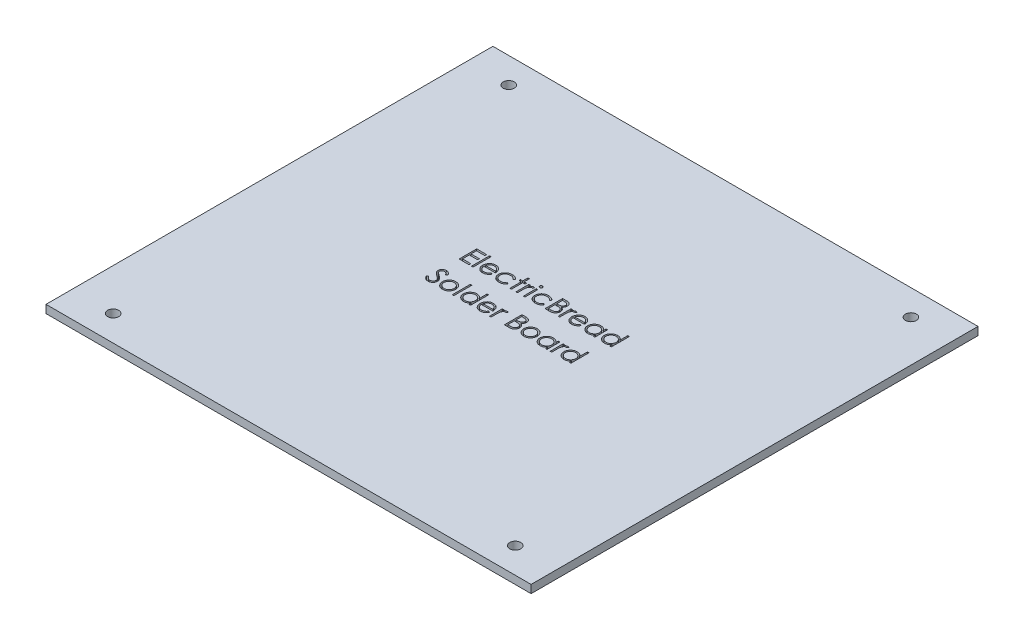
from build123d import *

# Parameters (mm, degrees)
SKETCH1_W           = 96.5
SKETCH1_H           = 88.9
BOSS_EXTRUDE1_DEPTH = 1.6
SKETCH2_R           = 1.1
SKETCH2_W           = 0.314102564
SKETCH2_H           = 3.58974359
SKETCH2_H_2         = 2.557692308
CUT_EXTRUDE1_DEPTH  = 1.6


with BuildPart() as part:
    # Sketch1 → Boss-Extrude1 (new body)
    with BuildSketch(Plane(origin=(0, 0, 0), x_dir=(1, 0, 0), z_dir=(0, 1, 0))):
        Rectangle(SKETCH1_W, SKETCH1_H)
    extrude(amount=BOSS_EXTRUDE1_DEPTH)

    # Sketch2 → Cut-Extrude1 (cut)
    # profile 1 of 29: a face of its own
    with BuildSketch(Plane(origin=(0, 1.6, 0), x_dir=(1, 0, 0), z_dir=(0, 1, 0))):
        with Locations(Location((-40, 39.35, 0), (0, 0, 270))):
            Circle(SKETCH2_R)
    # profile 2 of 29: a face of its own
    with BuildSketch(Plane(origin=(0, 1.6, 0), x_dir=(1, 0, 0), z_dir=(0, 1, 0))):
        with Locations(Location((40, 39.35, 0), (0, 0, 270))):
            Circle(SKETCH2_R)
    # profile 3 of 29: a face of its own
    with BuildSketch(Plane(origin=(0, 1.6, 0), x_dir=(1, 0, 0), z_dir=(0, 1, 0))):
        with Locations(Location((40, -39.35, 0), (0, 0, 270))):
            Circle(SKETCH2_R)
    # profile 4 of 29: a face of its own
    with BuildSketch(Plane(origin=(0, 1.6, 0), x_dir=(1, 0, 0), z_dir=(0, 1, 0))):
        with Locations(Location((-40, -39.35, 0), (0, 0, 270))):
            Circle(SKETCH2_R)
    # profile 5 of 29: a face of its own
    with BuildSketch(Plane(origin=(0, 1.6, 0), x_dir=(1, 0, 0), z_dir=(0, 1, 0))):
        Polygon((-14.968442936, 7.94842982), (-12.994083961, 7.94842982), (-12.994083961, 7.589455461), (-14.654340372, 7.589455461), (-14.654340372, 6.512532385), (-12.994083961, 6.512532385), (-12.994083961, 6.153558026), (-14.654340372, 6.153558026), (-14.654340372, 4.807404179), (-12.994083961, 4.807404179), (-12.994083961, 4.44842982), (-14.968442936, 4.44842982), align=None)
    # profile 6 of 29: a face of its own
    with BuildSketch(Plane(origin=(0, 1.6, 0), x_dir=(1, 0, 0), z_dir=(0, 1, 0))):
        with Locations((-12.343442936, 6.243301615)):
            Rectangle(SKETCH2_W, SKETCH2_H)
    # profile 7 of 29: a face of its own
    with BuildSketch(Plane(origin=(0, 1.6, 0), x_dir=(1, 0, 0), z_dir=(0, 1, 0))):
        with BuildLine():
            Line((-9.369284282, 5.256122128), (-9.090237808, 5.109587673))
            add(Edge.make_bspline(
                [(-9.090237808, 5.109587673), (-9.112474403, 5.070144342), (-9.155738011, 4.993403239), (-9.230138759, 4.887971378), (-9.308130832, 4.793123663), (-9.3932348, 4.711394008), (-9.482904479, 4.640142623), (-9.577637133, 4.577804799), (-9.677925951, 4.524686278), (-9.783775676, 4.47993375), (-9.896075227, 4.445524256), (-10.015096744, 4.421220035), (-10.141068239, 4.406196767), (-10.227414419, 4.404451626), (-10.271628032, 4.403558026)],
                knots=[0, 0, 0, 0, 1.120438281, 2.179929193, 3.190490725, 4.156257408, 5.095198341, 6.022838206, 6.959905092, 7.901321166, 8.864066838, 9.862729781, 10.905609505, 12, 12, 12, 12], degree=3))
            add(Edge.make_bspline(
                [(-10.271628032, 4.403558026), (-10.320770009, 4.404705201), (-10.416631771, 4.406943008), (-10.556171518, 4.426235472), (-10.687550937, 4.457707831), (-10.81076264, 4.501673372), (-10.925504893, 4.559100696), (-11.032005747, 4.629060178), (-11.130825273, 4.711192433), (-11.218849482, 4.806208876), (-11.298093365, 4.907890834), (-11.368019185, 5.013846718), (-11.426476616, 5.123809943), (-11.474029226, 5.237080467), (-11.512434091, 5.35294436), (-11.539200795, 5.472455828), (-11.554630543, 5.595291412), (-11.556994989, 5.678388748), (-11.558186525, 5.720264756)],
                knots=[0, 0, 0, 0, 1.145258523, 2.234067595, 3.276747158, 4.290159414, 5.277019952, 6.260822364, 7.254936242, 8.264827045, 9.274100331, 10.257902744, 11.220704747, 12.172965371, 13.118907548, 14.062713208, 15.023725156, 16, 16, 16, 16], degree=3))
            add(Edge.make_bspline(
                [(-11.558186525, 5.720264756), (-11.557127384, 5.759559587), (-11.555028306, 5.837436751), (-11.541797518, 5.952702296), (-11.518349225, 6.064730748), (-11.486172901, 6.173615196), (-11.444621655, 6.27917333), (-11.393789436, 6.381469394), (-11.333597058, 6.480394534), (-11.287124385, 6.542797668), (-11.263715372, 6.574231102)],
                knots=[0, 0, 0, 0, 1.024358464, 2.0301432, 3.019427413, 4.004406732, 4.986367066, 5.972626655, 6.978780325, 8, 8, 8, 8], degree=3))
            add(Edge.make_bspline(
                [(-11.263715372, 6.574231102), (-11.232007689, 6.612099973), (-11.169596742, 6.686638123), (-11.064040387, 6.784576449), (-10.949740191, 6.866620224), (-10.828128564, 6.93462736), (-10.69779209, 6.986301007), (-10.560482799, 7.024808589), (-10.414637213, 7.0463866), (-10.314931992, 7.049434434), (-10.263915692, 7.050993923)],
                knots=[0, 0, 0, 0, 1.030682036, 2.02871468, 2.997146059, 3.962720338, 4.930598197, 5.918074684, 6.934738563, 8, 8, 8, 8], degree=3))
            add(Edge.make_bspline(
                [(-10.263915692, 7.050993923), (-10.211468087, 7.049639874), (-10.108577841, 7.046983539), (-9.95854572, 7.022357205), (-9.816585003, 6.983304651), (-9.682752499, 6.92815086), (-9.557034638, 6.856991309), (-9.440248589, 6.768849467), (-9.330397076, 6.66643138), (-9.266488497, 6.58766817), (-9.233967775, 6.547588474)],
                knots=[0, 0, 0, 0, 1.056321875, 2.072262726, 3.055038591, 4.01806755, 4.982017516, 5.957941055, 6.960871419, 8, 8, 8, 8], degree=3))
            add(Edge.make_bspline(
                [(-9.233967775, 6.547588474), (-9.211840837, 6.517384893), (-9.167734244, 6.457178774), (-9.112487144, 6.359007617), (-9.064529749, 6.256297023), (-9.026196788, 6.147386726), (-8.995157287, 6.033567145), (-8.972700468, 5.914024601), (-8.95953085, 5.788794689), (-8.956942152, 5.703468134), (-8.955622423, 5.659968282)],
                knots=[0, 0, 0, 0, 0.94817472, 1.890038105, 2.849395472, 3.817997239, 4.812318967, 5.836947057, 6.897266129, 8, 8, 8, 8], degree=3))
            Line((-8.955622423, 5.659968282), (-11.244083961, 5.659968282))
            add(Edge.make_bspline(
                [(-11.244083961, 5.659968282), (-11.242544355, 5.626267818), (-11.239516781, 5.559997214), (-11.225401638, 5.463026431), (-11.203152864, 5.370653089), (-11.171883801, 5.283570047), (-11.134016956, 5.200639919), (-11.087631239, 5.122477882), (-11.032291685, 5.049439952), (-10.970565986, 4.980872815), (-10.901858891, 4.919812053), (-10.829576143, 4.865160277), (-10.752682578, 4.81935468), (-10.671784495, 4.782174791), (-10.58701271, 4.753068475), (-10.498340515, 4.733200654), (-10.405942398, 4.719893547), (-10.342956664, 4.718413882), (-10.310890852, 4.71766059)],
                knots=[0, 0, 0, 0, 1.094153842, 2.151609401, 3.174256925, 4.172055639, 5.149267565, 6.128595816, 7.11444997, 8.118368179, 9.117203808, 10.09244225, 11.054858984, 12.015122123, 12.976791628, 13.957293641, 14.960065497, 16, 16, 16, 16], degree=3))
            add(Edge.make_bspline(
                [(-10.310890852, 4.71766059), (-10.279539705, 4.718268646), (-10.217333014, 4.719475147), (-10.124692157, 4.731207058), (-10.033552629, 4.750177334), (-9.944291646, 4.776067324), (-9.8587208, 4.807644176), (-9.77947525, 4.845747034), (-9.706595034, 4.88789678), (-9.638478068, 4.936106456), (-9.572407074, 4.995114643), (-9.506864588, 5.068750364), (-9.436587935, 5.155837891), (-9.392598342, 5.221383557), (-9.369284282, 5.256122128)],
                knots=[0, 0, 0, 0, 0.99110716, 1.966546729, 2.947904876, 3.932708344, 4.903319531, 5.828989031, 6.710028674, 7.56322171, 8.463672341, 9.504779593, 10.677557249, 12, 12, 12, 12], degree=3))
        make_face()
        with BuildLine():
            add(Edge.make_bspline(
                [(-9.269724987, 5.974070846), (-9.281221612, 6.01573372), (-9.303348913, 6.09592134), (-9.349585277, 6.206962231), (-9.401656818, 6.305650132), (-9.46327855, 6.391229765), (-9.533097275, 6.467233278), (-9.613742458, 6.533651863), (-9.704178351, 6.593069314), (-9.803937492, 6.643221814), (-9.909579277, 6.685911672), (-10.020185469, 6.714536788), (-10.133043257, 6.73414633), (-10.209377543, 6.735972439), (-10.247789891, 6.736891359)],
                knots=[0, 0, 0, 0, 1.154881502, 2.222775134, 3.210006277, 4.132804581, 5.035138423, 5.962687519, 6.919655026, 7.923214229, 8.944639381, 9.960483929, 10.97369054, 12, 12, 12, 12], degree=3))
            add(Edge.make_bspline(
                [(-10.247789891, 6.736891359), (-10.279139329, 6.736279687), (-10.341110578, 6.735070541), (-10.432411647, 6.723600412), (-10.520091346, 6.704640567), (-10.604796633, 6.67867561), (-10.685417502, 6.644067008), (-10.76361227, 6.603483781), (-10.837392666, 6.553942198), (-10.883533961, 6.516183343), (-10.906844378, 6.497107705)],
                knots=[0, 0, 0, 0, 1.04873581, 2.073130211, 3.073294108, 4.04793562, 5.032784715, 6.005352987, 6.992311501, 8, 8, 8, 8], degree=3))
            add(Edge.make_bspline(
                [(-10.906844378, 6.497107705), (-10.92353766, 6.482013389), (-10.957320794, 6.451466173), (-11.002461316, 6.398836967), (-11.045681788, 6.342085405), (-11.085015441, 6.27904028), (-11.121093028, 6.210419501), (-11.154853005, 6.136801866), (-11.185239417, 6.057628736), (-11.202335527, 6.002456296), (-11.211131237, 5.974070846)],
                knots=[0, 0, 0, 0, 0.879870761, 1.780643979, 2.707998968, 3.669668524, 4.684282772, 5.740141944, 6.837334558, 8, 8, 8, 8], degree=3))
            Line((-11.211131237, 5.974070846), (-9.269724987, 5.974070846))
        make_face(mode=Mode.SUBTRACT)
    # profile 8 of 29: a face of its own
    with BuildSketch(Plane(origin=(0, 1.6, 0), x_dir=(1, 0, 0), z_dir=(0, 1, 0))):
        with BuildLine():
            Line((-5.814596782, 6.451534788), (-6.077517455, 6.28817341))
            add(Edge.make_bspline(
                [(-6.077517455, 6.28817341), (-6.10634732, 6.324001804), (-6.163094016, 6.394523914), (-6.261633252, 6.485533848), (-6.366644666, 6.563700889), (-6.479922714, 6.62740464), (-6.601308514, 6.676626091), (-6.730323365, 6.711456296), (-6.86694887, 6.733160539), (-6.960614069, 6.735627376), (-7.008607199, 6.736891359)],
                knots=[0, 0, 0, 0, 1.026593902, 2.0206758, 2.988051866, 3.946915611, 4.916868779, 5.907761954, 6.927957743, 8, 8, 8, 8], degree=3))
            add(Edge.make_bspline(
                [(-7.008607199, 6.736891359), (-7.046966155, 6.735834517), (-7.122513078, 6.733753095), (-7.233419232, 6.720742601), (-7.339061585, 6.697100593), (-7.440102294, 6.665949636), (-7.535822712, 6.624199346), (-7.626473631, 6.57338959), (-7.712859121, 6.51433955), (-7.792475862, 6.445929005), (-7.865304869, 6.371530337), (-7.928403783, 6.291776642), (-7.983340716, 6.20905675), (-8.026446673, 6.121305008), (-8.061721843, 6.030528955), (-8.084928563, 5.935015099), (-8.100393259, 5.835987092), (-8.102162587, 5.768468752), (-8.10305832, 5.734287192)],
                knots=[0, 0, 0, 0, 1.112346261, 2.190735716, 3.231507886, 4.247384806, 5.251966152, 6.253067467, 7.256802811, 8.280671706, 9.291813951, 10.270744147, 11.225547591, 12.165006084, 13.100104208, 14.043489273, 15.009504848, 16, 16, 16, 16], degree=3))
            add(Edge.make_bspline(
                [(-8.10305832, 5.734287192), (-8.101279068, 5.689517981), (-8.097744538, 5.600582785), (-8.070043078, 5.469304684), (-8.024698671, 5.342380993), (-7.96264082, 5.220712856), (-7.884163685, 5.108118701), (-7.791991122, 5.007135246), (-7.686072039, 4.919719218), (-7.567339708, 4.847246693), (-7.438581965, 4.788985326), (-7.30119186, 4.747477993), (-7.15629208, 4.72242562), (-7.057085332, 4.719269677), (-7.006503833, 4.71766059)],
                knots=[0, 0, 0, 0, 0.966302908, 1.919585723, 2.883856336, 3.870342332, 4.860282998, 5.839159637, 6.814385684, 7.815993281, 8.834850808, 9.858348828, 10.908058873, 12, 12, 12, 12], degree=3))
            add(Edge.make_bspline(
                [(-7.006503833, 4.71766059), (-6.960148649, 4.718960087), (-6.86904841, 4.721513944), (-6.735881125, 4.743042907), (-6.609101214, 4.778286541), (-6.488713184, 4.827434191), (-6.374937018, 4.890961707), (-6.268507843, 4.969320877), (-6.167307905, 5.060257478), (-6.107810928, 5.130575449), (-6.077517455, 5.166378538)],
                knots=[0, 0, 0, 0, 1.039848629, 2.043578496, 3.018386758, 3.987534228, 4.954977003, 5.934852016, 6.948509513, 8, 8, 8, 8], degree=3))
            Line((-6.077517455, 5.166378538), (-5.814596782, 4.993902577))
            add(Edge.make_bspline(
                [(-5.814596782, 4.993902577), (-5.830184484, 4.97101185), (-5.861308151, 4.925306373), (-5.913335776, 4.860862257), (-5.969455608, 4.800540574), (-6.029448705, 4.744422184), (-6.092531715, 4.691164165), (-6.160859624, 4.64331259), (-6.232229236, 4.598177768), (-6.307478394, 4.557564896), (-6.385829092, 4.521058574), (-6.467171081, 4.489667403), (-6.551150894, 4.462697297), (-6.63786727, 4.441259951), (-6.727491168, 4.424149112), (-6.819790803, 4.412795411), (-6.914734384, 4.404320129), (-6.978906536, 4.403814263), (-7.011411686, 4.403558026)],
                knots=[0, 0, 0, 0, 0.954134338, 1.905101784, 2.851144739, 3.791306361, 4.734911809, 5.6936923, 6.663572882, 7.643865596, 8.638447847, 9.640600242, 10.646758161, 11.676244097, 12.717260333, 13.78922464, 14.880174919, 16, 16, 16, 16], degree=3))
            add(Edge.make_bspline(
                [(-7.011411686, 4.403558026), (-7.061022569, 4.404449305), (-7.158260261, 4.40619622), (-7.300582769, 4.425404696), (-7.436596436, 4.454362312), (-7.566254794, 4.495926046), (-7.689578029, 4.549430821), (-7.806451147, 4.614787736), (-7.916487165, 4.692539526), (-8.018597948, 4.781302295), (-8.112379394, 4.877542936), (-8.192905584, 4.981392854), (-8.262750855, 5.089033902), (-8.318838398, 5.202843428), (-8.363485324, 5.3213088), (-8.393990157, 5.44537904), (-8.413719895, 5.574031294), (-8.416003274, 5.661764176), (-8.417160884, 5.70624232)],
                knots=[0, 0, 0, 0, 1.1129367, 2.181364009, 3.217532258, 4.231199276, 5.232079859, 6.230262199, 7.231623845, 8.250719726, 9.263571943, 10.242672461, 11.195837495, 12.138959767, 13.085126421, 14.0317438, 15.002148558, 16, 16, 16, 16], degree=3))
            add(Edge.make_bspline(
                [(-8.417160884, 5.70624232), (-8.416719868, 5.736420755), (-8.415842614, 5.796450642), (-8.405780687, 5.885545709), (-8.392782214, 5.973454254), (-8.370756477, 6.059061974), (-8.345315845, 6.143667264), (-8.312840313, 6.226250365), (-8.274744918, 6.307195038), (-8.231492971, 6.386292767), (-8.182804226, 6.462242307), (-8.128922993, 6.533995972), (-8.071878656, 6.602415737), (-8.009002544, 6.665139498), (-7.942962891, 6.724675689), (-7.871891315, 6.779433813), (-7.796195463, 6.829574804), (-7.717012141, 6.87602582), (-7.634387429, 6.917385255), (-7.548820759, 6.953018493), (-7.46082773, 6.983471069), (-7.370267585, 7.007579988), (-7.277741412, 7.027797411), (-7.182520074, 7.040515258), (-7.084967852, 7.04950153), (-7.018911829, 7.050492323), (-6.985470179, 7.050993923)],
                knots=[0, 0, 0, 0, 0.990994727, 1.971252077, 2.943264845, 3.907940874, 4.872158414, 5.844625996, 6.82015047, 7.809835459, 8.804511986, 9.781214284, 10.756496977, 11.728388426, 12.696359165, 13.676225489, 14.672885716, 15.677705647, 16.690706858, 17.706033469, 18.721040654, 19.747369689, 20.783475414, 21.830280724, 22.901553713, 24, 24, 24, 24], degree=3))
            add(Edge.make_bspline(
                [(-6.985470179, 7.050993923), (-6.943590071, 7.050072032), (-6.860039192, 7.048232858), (-6.736098485, 7.032754206), (-6.613983291, 7.009417789), (-6.495836188, 6.974844959), (-6.383089673, 6.932981304), (-6.277554223, 6.885968589), (-6.181714119, 6.831373986), (-6.09378653, 6.771653872), (-6.013607013, 6.704292966), (-5.94035252, 6.628486008), (-5.872520871, 6.544627529), (-5.834064159, 6.482821798), (-5.814596782, 6.451534788)],
                knots=[0, 0, 0, 0, 1.095225653, 2.184976855, 3.262915854, 4.344593502, 5.400796181, 6.407717688, 7.363229445, 8.282371371, 9.184954523, 10.097238608, 11.036792983, 12, 12, 12, 12], degree=3))
        make_face()
    # profile 9 of 29: a face of its own
    with BuildSketch(Plane(origin=(0, 1.6, 0), x_dir=(1, 0, 0), z_dir=(0, 1, 0))):
        Polygon((-4.87228909, 8.03817341), (-4.558186525, 8.03817341), (-4.558186525, 7.006122128), (-4.109468577, 7.006122128), (-4.109468577, 6.692019564), (-4.558186525, 6.692019564), (-4.558186525, 4.44842982), (-4.87228909, 4.44842982), (-4.87228909, 6.692019564), (-5.321007038, 6.692019564), (-5.321007038, 7.006122128), (-4.87228909, 7.006122128), align=None)
    # profile 10 of 29: a face of its own
    with BuildSketch(Plane(origin=(0, 1.6, 0), x_dir=(1, 0, 0), z_dir=(0, 1, 0))):
        with BuildLine():
            Line((-3.660750628, 7.006122128), (-3.346648064, 7.006122128))
            Line((-3.346648064, 7.006122128), (-3.346648064, 6.629619724))
            add(Edge.make_bspline(
                [(-3.346648064, 6.629619724), (-3.323459305, 6.664675553), (-3.279110984, 6.731719552), (-3.205398055, 6.820388853), (-3.129894724, 6.893803899), (-3.052239536, 6.952307418), (-2.971861436, 6.996120537), (-2.890524485, 7.028213572), (-2.806949015, 7.047190887), (-2.750787091, 7.049724546), (-2.722649666, 7.050993923)],
                knots=[0, 0, 0, 0, 1.2804753, 2.448899062, 3.506932113, 4.484331642, 5.4025378, 6.288909075, 7.142734305, 8, 8, 8, 8], degree=3))
            add(Edge.make_bspline(
                [(-2.722649666, 7.050993923), (-2.70082334, 7.049803396), (-2.655914255, 7.047353811), (-2.587931665, 7.030142986), (-2.517888213, 7.002664963), (-2.472745826, 6.976824741), (-2.449212166, 6.963353699)],
                knots=[0, 0, 0, 0, 0.901110191, 1.854092781, 2.881294221, 4, 4, 4, 4], degree=3))
            Line((-2.449212166, 6.963353699), (-2.621688128, 6.691318442))
            add(Edge.make_bspline(
                [(-2.621688128, 6.691318442), (-2.636797149, 6.698058708), (-2.665476964, 6.710853024), (-2.70743153, 6.725995034), (-2.746112867, 6.73491095), (-2.770756425, 6.736261667), (-2.782245019, 6.736891359)],
                knots=[0, 0, 0, 0, 1.180555205, 2.24091978, 3.179933427, 4, 4, 4, 4], degree=3))
            add(Edge.make_bspline(
                [(-2.782245019, 6.736891359), (-2.807450753, 6.735211322), (-2.858863143, 6.731784532), (-2.934347642, 6.704845724), (-3.007594847, 6.661320484), (-3.06576651, 6.613049373), (-3.110808763, 6.566501575), (-3.142948988, 6.525853173), (-3.172431735, 6.480274541), (-3.200601956, 6.430544857), (-3.22626825, 6.375815011), (-3.250222919, 6.316631798), (-3.271881782, 6.252926669), (-3.284232026, 6.208544149), (-3.29055832, 6.185809628)],
                knots=[0, 0, 0, 0, 1.125678352, 2.296057538, 3.5422874, 4.923748041, 5.663163013, 6.437101912, 7.23742474, 8.08941207, 8.991984279, 9.93940061, 10.944477711, 12, 12, 12, 12], degree=3))
            add(Edge.make_bspline(
                [(-3.29055832, 6.185809628), (-3.295290714, 6.165532455), (-3.305772605, 6.120620056), (-3.315964143, 6.045271531), (-3.326033661, 5.956247872), (-3.33313028, 5.85330128), (-3.339708322, 5.736688836), (-3.343418404, 5.60623289), (-3.346521544, 5.461799539), (-3.346604611, 5.360825186), (-3.346648064, 5.308005141)],
                knots=[0, 0, 0, 0, 0.566838948, 1.255505196, 2.06880316, 3.007127437, 4.065329342, 5.249902469, 6.561414163, 8, 8, 8, 8], degree=3))
            Line((-3.346648064, 5.308005141), (-3.346648064, 4.44842982))
            Line((-3.346648064, 4.44842982), (-3.660750628, 4.44842982))
            Line((-3.660750628, 4.44842982), (-3.660750628, 7.006122128))
        make_face()
    # profile 11 of 29: a face of its own
    with BuildSketch(Plane(origin=(0, 1.6, 0), x_dir=(1, 0, 0), z_dir=(0, 1, 0))):
        with BuildLine():
            add(Edge.make_bspline(
                [(-2.024332359, 8.083045205), (-2.004841043, 8.082141053), (-1.966673303, 8.080370549), (-1.911480035, 8.065209072), (-1.861223023, 8.039509386), (-1.816645291, 8.005029705), (-1.778393404, 7.964480262), (-1.751612693, 7.917219293), (-1.734400297, 7.866160655), (-1.732321742, 7.830545565), (-1.731263449, 7.812412192)],
                knots=[0, 0, 0, 0, 1.055194115, 2.066272739, 3.074728998, 4.095836921, 5.109056067, 6.073838105, 7.019297344, 8, 8, 8, 8], degree=3))
            add(Edge.make_bspline(
                [(-1.731263449, 7.812412192), (-1.732345608, 7.794749539), (-1.73448491, 7.759832564), (-1.751599399, 7.709659092), (-1.778621636, 7.663054808), (-1.816620762, 7.622584098), (-1.861229523, 7.588123478), (-1.911478309, 7.562418739), (-1.966673757, 7.547258602), (-2.004841197, 7.545487913), (-2.024332359, 7.544583667)],
                knots=[0, 0, 0, 0, 0.96129708, 1.900370562, 2.859976407, 3.87933698, 4.906634145, 5.921202961, 6.938410037, 8, 8, 8, 8], degree=3))
            add(Edge.make_bspline(
                [(-2.024332359, 7.544583667), (-2.043600634, 7.545453387), (-2.081103814, 7.547146184), (-2.135470656, 7.562716201), (-2.185299146, 7.588132274), (-2.229963819, 7.622358459), (-2.267194012, 7.663303357), (-2.294292337, 7.709630651), (-2.311367299, 7.759839805), (-2.313511928, 7.794751972), (-2.314596782, 7.812412192)],
                knots=[0, 0, 0, 0, 1.054934014, 2.053291228, 3.073705704, 4.106921865, 5.123545215, 6.088680038, 7.033164197, 8, 8, 8, 8], degree=3))
            add(Edge.make_bspline(
                [(-2.314596782, 7.812412192), (-2.313535695, 7.830543042), (-2.311451654, 7.866153174), (-2.294279538, 7.917248207), (-2.26741973, 7.964229709), (-2.229939167, 8.005255209), (-2.185305706, 8.039500643), (-2.135468961, 8.064911625), (-2.081104262, 8.080482964), (-2.043600786, 8.082175579), (-2.024332359, 8.083045205)],
                knots=[0, 0, 0, 0, 0.98631895, 1.937192651, 2.907499808, 3.917963147, 4.944918757, 5.95915025, 6.951458133, 8, 8, 8, 8], degree=3))
        make_face()
    # profile 12 of 29: a face of its own
    with BuildSketch(Plane(origin=(0, 1.6, 0), x_dir=(1, 0, 0), z_dir=(0, 1, 0))):
        with Locations((-2.022930115, 5.727275974)):
            Rectangle(SKETCH2_W, SKETCH2_H_2)
    # profile 13 of 29: a face of its own
    with BuildSketch(Plane(origin=(0, 1.6, 0), x_dir=(1, 0, 0), z_dir=(0, 1, 0))):
        with BuildLine():
            Line((1.409762192, 6.451534788), (1.146841519, 6.28817341))
            add(Edge.make_bspline(
                [(1.146841519, 6.28817341), (1.118011654, 6.324001804), (1.061264959, 6.394523914), (0.962725722, 6.485533848), (0.857714308, 6.563700889), (0.744436261, 6.62740464), (0.62305046, 6.676626091), (0.494035609, 6.711456296), (0.357410104, 6.733160539), (0.263744905, 6.735627376), (0.215751776, 6.736891359)],
                knots=[0, 0, 0, 0, 1.026593902, 2.0206758, 2.988051866, 3.946915611, 4.916868779, 5.907761954, 6.927957743, 8, 8, 8, 8], degree=3))
            add(Edge.make_bspline(
                [(0.215751776, 6.736891359), (0.177392819, 6.735834517), (0.101845896, 6.733753095), (-0.009060257, 6.720742601), (-0.11470261, 6.697100593), (-0.215743319, 6.665949636), (-0.311463738, 6.624199346), (-0.402114656, 6.57338959), (-0.488500146, 6.51433955), (-0.568116888, 6.445929005), (-0.640945895, 6.371530337), (-0.704044809, 6.291776642), (-0.758981742, 6.20905675), (-0.802087698, 6.121305008), (-0.837362869, 6.030528955), (-0.860569589, 5.935015099), (-0.876034284, 5.835987092), (-0.877803613, 5.768468752), (-0.878699346, 5.734287192)],
                knots=[0, 0, 0, 0, 1.112346261, 2.190735716, 3.231507886, 4.247384806, 5.251966152, 6.253067467, 7.256802811, 8.280671706, 9.291813951, 10.270744147, 11.225547591, 12.165006084, 13.100104208, 14.043489273, 15.009504848, 16, 16, 16, 16], degree=3))
            add(Edge.make_bspline(
                [(-0.878699346, 5.734287192), (-0.876920094, 5.689517981), (-0.873385563, 5.600582785), (-0.845684104, 5.469304684), (-0.800339696, 5.342380993), (-0.738281846, 5.220712856), (-0.659804711, 5.108118701), (-0.567632148, 5.007135246), (-0.461713065, 4.919719218), (-0.342980734, 4.847246693), (-0.21422299, 4.788985326), (-0.076832886, 4.747477993), (0.068066895, 4.72242562), (0.167273642, 4.719269677), (0.217855141, 4.71766059)],
                knots=[0, 0, 0, 0, 0.966302908, 1.919585723, 2.883856336, 3.870342332, 4.860282998, 5.839159637, 6.814385684, 7.815993281, 8.834850808, 9.858348828, 10.908058873, 12, 12, 12, 12], degree=3))
            add(Edge.make_bspline(
                [(0.217855141, 4.71766059), (0.264210326, 4.718960087), (0.355310564, 4.721513944), (0.488477849, 4.743042907), (0.61525776, 4.778286541), (0.73564579, 4.827434191), (0.849421957, 4.890961707), (0.955851131, 4.969320877), (1.05705107, 5.060257478), (1.116548046, 5.130575449), (1.146841519, 5.166378538)],
                knots=[0, 0, 0, 0, 1.039848629, 2.043578496, 3.018386758, 3.987534228, 4.954977003, 5.934852016, 6.948509513, 8, 8, 8, 8], degree=3))
            Line((1.146841519, 5.166378538), (1.409762192, 4.993902577))
            add(Edge.make_bspline(
                [(1.409762192, 4.993902577), (1.39417449, 4.97101185), (1.363050823, 4.925306373), (1.311023198, 4.860862257), (1.254903366, 4.800540574), (1.194910269, 4.744422184), (1.13182726, 4.691164165), (1.06349935, 4.64331259), (0.992129738, 4.598177768), (0.916880581, 4.557564896), (0.838529883, 4.521058574), (0.757187893, 4.489667403), (0.67320808, 4.462697297), (0.586491704, 4.441259951), (0.496867806, 4.424149112), (0.404568171, 4.412795411), (0.30962459, 4.404320129), (0.245452439, 4.403814263), (0.212947289, 4.403558026)],
                knots=[0, 0, 0, 0, 0.954134338, 1.905101784, 2.851144739, 3.791306361, 4.734911809, 5.6936923, 6.663572882, 7.643865596, 8.638447847, 9.640600242, 10.646758161, 11.676244097, 12.717260333, 13.78922464, 14.880174919, 16, 16, 16, 16], degree=3))
            add(Edge.make_bspline(
                [(0.212947289, 4.403558026), (0.163336405, 4.404449305), (0.066098713, 4.40619622), (-0.076223795, 4.425404696), (-0.212237462, 4.454362312), (-0.34189582, 4.495926046), (-0.465219054, 4.549430821), (-0.582092172, 4.614787736), (-0.692128191, 4.692539526), (-0.794238973, 4.781302295), (-0.88802042, 4.877542936), (-0.96854661, 4.981392854), (-1.038391881, 5.089033902), (-1.094479424, 5.202843428), (-1.13912635, 5.3213088), (-1.169631183, 5.44537904), (-1.18936092, 5.574031294), (-1.1916443, 5.661764176), (-1.19280191, 5.70624232)],
                knots=[0, 0, 0, 0, 1.1129367, 2.181364009, 3.217532258, 4.231199276, 5.232079859, 6.230262199, 7.231623845, 8.250719726, 9.263571943, 10.242672461, 11.195837495, 12.138959767, 13.085126421, 14.0317438, 15.002148558, 16, 16, 16, 16], degree=3))
            add(Edge.make_bspline(
                [(-1.19280191, 5.70624232), (-1.192360894, 5.736420755), (-1.19148364, 5.796450642), (-1.181421712, 5.885545709), (-1.168423239, 5.973454254), (-1.146397502, 6.059061974), (-1.120956871, 6.143667264), (-1.088481339, 6.226250365), (-1.050385944, 6.307195038), (-1.007133997, 6.386292767), (-0.958445252, 6.462242307), (-0.904564018, 6.533995972), (-0.847519682, 6.602415737), (-0.78464357, 6.665139498), (-0.718603916, 6.724675689), (-0.64753234, 6.779433813), (-0.571836489, 6.829574804), (-0.492653166, 6.87602582), (-0.410028455, 6.917385255), (-0.324461785, 6.953018493), (-0.236468755, 6.983471069), (-0.145908611, 7.007579988), (-0.053382438, 7.027797411), (0.0418389, 7.040515258), (0.139391122, 7.04950153), (0.205447145, 7.050492323), (0.238888795, 7.050993923)],
                knots=[0, 0, 0, 0, 0.990994727, 1.971252077, 2.943264845, 3.907940874, 4.872158414, 5.844625996, 6.82015047, 7.809835459, 8.804511986, 9.781214284, 10.756496977, 11.728388426, 12.696359165, 13.676225489, 14.672885716, 15.677705647, 16.690706858, 17.706033469, 18.721040654, 19.747369689, 20.783475414, 21.830280724, 22.901553713, 24, 24, 24, 24], degree=3))
            add(Edge.make_bspline(
                [(0.238888795, 7.050993923), (0.280768903, 7.050072032), (0.364319783, 7.048232858), (0.488260489, 7.032754206), (0.610375683, 7.009417789), (0.728522787, 6.974844959), (0.841269301, 6.932981304), (0.946804751, 6.885968589), (1.042644855, 6.831373986), (1.130572444, 6.771653872), (1.210751962, 6.704292966), (1.284006454, 6.628486008), (1.351838104, 6.544627529), (1.390294815, 6.482821798), (1.409762192, 6.451534788)],
                knots=[0, 0, 0, 0, 1.095225653, 2.184976855, 3.262915854, 4.344593502, 5.400796181, 6.407717688, 7.363229445, 8.282371371, 9.184954523, 10.097238608, 11.036792983, 12, 12, 12, 12], degree=3))
        make_face()
    # profile 14 of 29: a face of its own
    with BuildSketch(Plane(origin=(0, 1.6, 0), x_dir=(1, 0, 0), z_dir=(0, 1, 0))):
        with BuildLine():
            Line((2.12771091, 7.94842982), (2.810603539, 7.94842982))
            add(Edge.make_bspline(
                [(2.810603539, 7.94842982), (2.844032017, 7.94825407), (2.908824727, 7.947913422), (3.003044169, 7.942630291), (3.09129298, 7.935426621), (3.173596752, 7.923996528), (3.249917454, 7.910204751), (3.320485092, 7.893502935), (3.385075264, 7.873476321), (3.462188, 7.84163004), (3.550108661, 7.794306872), (3.645307054, 7.724378307), (3.726711293, 7.638845844), (3.79689761, 7.542363188), (3.85269873, 7.436227416), (3.893068027, 7.322968228), (3.918625903, 7.204046486), (3.921254337, 7.122403308), (3.922582705, 7.08114216)],
                knots=[0, 0, 0, 0, 1.001505555, 1.941167018, 2.826882275, 3.653841531, 4.429895133, 5.150066043, 5.825578002, 6.45369114, 7.647487171, 8.808567382, 9.977351308, 11.170798116, 12.373658725, 13.556498008, 14.765093433, 16, 16, 16, 16], degree=3))
            add(Edge.make_bspline(
                [(3.922582705, 7.08114216), (3.921489487, 7.042489604), (3.91934121, 6.966533687), (3.89879845, 6.855439578), (3.866637782, 6.749688359), (3.821932533, 6.649665974), (3.763830536, 6.557632361), (3.694972218, 6.472845095), (3.611895415, 6.398894038), (3.549652175, 6.357551135), (3.51803543, 6.336550814)],
                knots=[0, 0, 0, 0, 1.044552857, 2.05264487, 3.044412934, 4.028983338, 5.005914585, 5.980388656, 6.974128949, 8, 8, 8, 8], degree=3))
            add(Edge.make_bspline(
                [(3.51803543, 6.336550814), (3.557795857, 6.321285815), (3.633867405, 6.292080091), (3.738553417, 6.240444627), (3.828748262, 6.184282516), (3.905145408, 6.122950666), (3.970483063, 6.056841855), (4.027536005, 5.984986741), (4.076217379, 5.906447983), (4.117930302, 5.822044448), (4.150479058, 5.732637979), (4.174854963, 5.639067203), (4.188822412, 5.541667648), (4.190810053, 5.475382269), (4.191813475, 5.441919404)],
                knots=[0, 0, 0, 0, 1.27268992, 2.434971085, 3.483601985, 4.442670788, 5.356604649, 6.2567628, 7.179492994, 8.113709626, 9.066344395, 10.018646069, 10.999752585, 12, 12, 12, 12], degree=3))
            add(Edge.make_bspline(
                [(4.191813475, 5.441919404), (4.190836629, 5.407752532), (4.188914657, 5.340528254), (4.174734685, 5.241773119), (4.150725578, 5.147398172), (4.117654431, 5.05679299), (4.074492117, 4.970132855), (4.021964153, 4.887319591), (3.959332589, 4.809185261), (3.88926972, 4.734861637), (3.810007574, 4.66803385), (3.72449182, 4.608518143), (3.6316455, 4.559572081), (3.532993506, 4.51845606), (3.42742919, 4.487048861), (3.315426582, 4.465076287), (3.19708228, 4.45027125), (3.115872529, 4.449054046), (3.074225334, 4.44842982)],
                knots=[0, 0, 0, 0, 0.978564426, 1.925352924, 2.850884081, 3.763762016, 4.682927383, 5.618979971, 6.567305752, 7.547517671, 8.540179244, 9.531824382, 10.526200242, 11.540722885, 12.589160233, 13.674978461, 14.80764778, 16, 16, 16, 16], degree=3))
            Line((3.074225334, 4.44842982), (2.12771091, 4.44842982))
            Line((2.12771091, 4.44842982), (2.12771091, 7.94842982))
        make_face()
        with BuildLine():
            Line((2.441813475, 7.589455461), (2.441813475, 6.46766059))
            Line((2.441813475, 6.46766059), (2.652851135, 6.46766059))
            add(Edge.make_bspline(
                [(2.652851135, 6.46766059), (2.68369993, 6.468060513), (2.743306089, 6.468833245), (2.829625986, 6.471046762), (2.909751004, 6.477244806), (2.983542837, 6.483441068), (3.050885281, 6.493515656), (3.111629143, 6.505507779), (3.16672774, 6.518190684), (3.230267285, 6.539760171), (3.302340234, 6.571637846), (3.379173338, 6.621109682), (3.446907807, 6.680034035), (3.504104995, 6.748024997), (3.550916466, 6.822891183), (3.583430181, 6.903438063), (3.605477465, 6.987658195), (3.607468996, 7.045476448), (3.608480141, 7.074832064)],
                knots=[0, 0, 0, 0, 1.156816544, 2.235205308, 3.236616184, 4.169592532, 5.011045266, 5.787822928, 6.49130361, 7.128639758, 8.301311294, 9.436451833, 10.541879658, 11.654887649, 12.756523258, 13.837046038, 14.901820046, 16, 16, 16, 16], degree=3))
            add(Edge.make_bspline(
                [(3.608480141, 7.074832064), (3.607953961, 7.094257836), (3.606921801, 7.132363608), (3.598468499, 7.187912962), (3.584100924, 7.240156714), (3.565646631, 7.289810825), (3.539857942, 7.335322675), (3.509494479, 7.378265871), (3.472808789, 7.417177989), (3.431051476, 7.453547487), (3.383042853, 7.485792015), (3.328811561, 7.514032778), (3.267623884, 7.536773555), (3.200511029, 7.556689707), (3.126439942, 7.570678001), (3.046265388, 7.582331389), (2.959330669, 7.588264131), (2.899185567, 7.589049494), (2.868095526, 7.589455461)],
                knots=[0, 0, 0, 0, 0.91205012, 1.789085906, 2.630437955, 3.453916878, 4.269457761, 5.079663411, 5.91843418, 6.774407191, 7.675494373, 8.627863946, 9.638891023, 10.736472738, 11.911756761, 13.175263542, 14.539845004, 16, 16, 16, 16], degree=3))
            Line((2.868095526, 7.589455461), (2.441813475, 7.589455461))
        make_face(mode=Mode.SUBTRACT)
        with BuildLine():
            Line((2.441813475, 6.108686231), (2.441813475, 4.807404179))
            Line((2.441813475, 4.807404179), (2.88912918, 4.807404179))
            add(Edge.make_bspline(
                [(2.88912918, 4.807404179), (2.921148106, 4.807787927), (2.982860364, 4.808527549), (3.071961594, 4.810942104), (3.154544698, 4.81643438), (3.230232834, 4.825080229), (3.299843286, 4.834458678), (3.362540989, 4.847069959), (3.418834183, 4.86151892), (3.484108491, 4.883853092), (3.557611999, 4.918549563), (3.636822855, 4.970863789), (3.707249073, 5.033187097), (3.767054333, 5.105318011), (3.816067321, 5.183749338), (3.851722776, 5.266894688), (3.873713633, 5.353380216), (3.876375802, 5.412346928), (3.87771091, 5.441919404)],
                knots=[0, 0, 0, 0, 1.160039823, 2.235823828, 3.228722157, 4.157150951, 4.99529583, 5.772374946, 6.472645482, 7.099169577, 8.269452708, 9.405989375, 10.527446681, 11.663510218, 12.788923519, 13.866172445, 14.929861265, 16, 16, 16, 16], degree=3))
            add(Edge.make_bspline(
                [(3.87771091, 5.441919404), (3.877434806, 5.460412744), (3.876887051, 5.497101126), (3.868626436, 5.551016945), (3.856612566, 5.603242819), (3.841081132, 5.653920559), (3.818461665, 5.702133935), (3.79205512, 5.748836495), (3.761093719, 5.794089974), (3.712849553, 5.851302228), (3.642677568, 5.917219241), (3.542970793, 5.981756743), (3.429598495, 6.03380455), (3.347371002, 6.055904026), (3.304894404, 6.067320045)],
                knots=[0, 0, 0, 0, 0.723448775, 1.435228256, 2.130040452, 2.821711965, 3.505591119, 4.210454504, 4.921174351, 5.648778258, 7.137944449, 8.670945889, 10.280296675, 12, 12, 12, 12], degree=3))
            add(Edge.make_bspline(
                [(3.304894404, 6.067320045), (3.287865308, 6.070775129), (3.250942716, 6.078266463), (3.190735135, 6.086174167), (3.121999266, 6.093219227), (3.044576389, 6.098430384), (2.958368548, 6.103816928), (2.863191629, 6.105911749), (2.759434315, 6.108411009), (2.687441942, 6.108592143), (2.650046648, 6.108686231)],
                knots=[0, 0, 0, 0, 0.634451884, 1.375622551, 2.216452059, 3.157844607, 4.20941857, 5.370758133, 6.634282058, 8, 8, 8, 8], degree=3))
            Line((2.650046648, 6.108686231), (2.441813475, 6.108686231))
        make_face(mode=Mode.SUBTRACT)
    # profile 15 of 29: a face of its own
    with BuildSketch(Plane(origin=(0, 1.6, 0), x_dir=(1, 0, 0), z_dir=(0, 1, 0))):
        with BuildLine():
            Line((4.730275013, 7.006122128), (5.044377577, 7.006122128))
            Line((5.044377577, 7.006122128), (5.044377577, 6.629619724))
            add(Edge.make_bspline(
                [(5.044377577, 6.629619724), (5.067566336, 6.664675553), (5.111914657, 6.731719552), (5.185627586, 6.820388853), (5.261130917, 6.893803899), (5.338786105, 6.952307418), (5.419164205, 6.996120537), (5.500501156, 7.028213572), (5.584076626, 7.047190887), (5.64023855, 7.049724546), (5.668375975, 7.050993923)],
                knots=[0, 0, 0, 0, 1.2804753, 2.448899062, 3.506932113, 4.484331642, 5.4025378, 6.288909075, 7.142734305, 8, 8, 8, 8], degree=3))
            add(Edge.make_bspline(
                [(5.668375975, 7.050993923), (5.690202301, 7.049803396), (5.735111386, 7.047353811), (5.803093976, 7.030142986), (5.873137428, 7.002664963), (5.918279815, 6.976824741), (5.941813475, 6.963353699)],
                knots=[0, 0, 0, 0, 0.901110191, 1.854092781, 2.881294221, 4, 4, 4, 4], degree=3))
            Line((5.941813475, 6.963353699), (5.769337513, 6.691318442))
            add(Edge.make_bspline(
                [(5.769337513, 6.691318442), (5.754228492, 6.698058708), (5.725548677, 6.710853024), (5.683594111, 6.725995034), (5.644912774, 6.73491095), (5.620269216, 6.736261667), (5.608780622, 6.736891359)],
                knots=[0, 0, 0, 0, 1.180555205, 2.24091978, 3.179933427, 4, 4, 4, 4], degree=3))
            add(Edge.make_bspline(
                [(5.608780622, 6.736891359), (5.583574888, 6.735211322), (5.532162498, 6.731784532), (5.456677999, 6.704845724), (5.383430794, 6.661320484), (5.325259131, 6.613049373), (5.280216878, 6.566501575), (5.248076653, 6.525853173), (5.218593906, 6.480274541), (5.190423685, 6.430544857), (5.164757391, 6.375815011), (5.140802722, 6.316631798), (5.119143859, 6.252926669), (5.106793615, 6.208544149), (5.100467321, 6.185809628)],
                knots=[0, 0, 0, 0, 1.125678352, 2.296057538, 3.5422874, 4.923748041, 5.663163013, 6.437101912, 7.23742474, 8.08941207, 8.991984279, 9.93940061, 10.944477711, 12, 12, 12, 12], degree=3))
            add(Edge.make_bspline(
                [(5.100467321, 6.185809628), (5.095734927, 6.165532455), (5.085253036, 6.120620056), (5.075061498, 6.045271531), (5.06499198, 5.956247872), (5.057895361, 5.85330128), (5.051317319, 5.736688836), (5.047607237, 5.60623289), (5.044504097, 5.461799539), (5.04442103, 5.360825186), (5.044377577, 5.308005141)],
                knots=[0, 0, 0, 0, 0.566838948, 1.255505196, 2.06880316, 3.007127437, 4.065329342, 5.249902469, 6.561414163, 8, 8, 8, 8], degree=3))
            Line((5.044377577, 5.308005141), (5.044377577, 4.44842982))
            Line((5.044377577, 4.44842982), (4.730275013, 4.44842982))
            Line((4.730275013, 4.44842982), (4.730275013, 7.006122128))
        make_face()
    # profile 16 of 29: a face of its own
    with BuildSketch(Plane(origin=(0, 1.6, 0), x_dir=(1, 0, 0), z_dir=(0, 1, 0))):
        with BuildLine():
            Line((8.355074692, 5.256122128), (8.634121167, 5.109587673))
            add(Edge.make_bspline(
                [(8.634121167, 5.109587673), (8.611884572, 5.070144342), (8.568620963, 4.993403239), (8.494220215, 4.887971378), (8.416228143, 4.793123663), (8.331124175, 4.711394008), (8.241454496, 4.640142623), (8.146721841, 4.577804799), (8.046433023, 4.524686278), (7.940583298, 4.47993375), (7.828283747, 4.445524256), (7.709262231, 4.421220035), (7.583290735, 4.406196767), (7.496944556, 4.404451626), (7.452730942, 4.403558026)],
                knots=[0, 0, 0, 0, 1.120438281, 2.179929193, 3.190490725, 4.156257408, 5.095198341, 6.022838206, 6.959905092, 7.901321166, 8.864066838, 9.862729781, 10.905609505, 12, 12, 12, 12], degree=3))
            add(Edge.make_bspline(
                [(7.452730942, 4.403558026), (7.403588965, 4.404705201), (7.307727203, 4.406943008), (7.168187456, 4.426235472), (7.036808038, 4.457707831), (6.913596334, 4.501673372), (6.798854082, 4.559100696), (6.692353227, 4.629060178), (6.593533701, 4.711192433), (6.505509492, 4.806208876), (6.426265609, 4.907890834), (6.356339789, 5.013846718), (6.297882358, 5.123809943), (6.250329748, 5.237080467), (6.211924883, 5.35294436), (6.185158179, 5.472455828), (6.169728431, 5.595291412), (6.167363986, 5.678388748), (6.166172449, 5.720264756)],
                knots=[0, 0, 0, 0, 1.145258523, 2.234067595, 3.276747158, 4.290159414, 5.277019952, 6.260822364, 7.254936242, 8.264827045, 9.274100331, 10.257902744, 11.220704747, 12.172965371, 13.118907548, 14.062713208, 15.023725156, 16, 16, 16, 16], degree=3))
            add(Edge.make_bspline(
                [(6.166172449, 5.720264756), (6.16723159, 5.759559587), (6.169330668, 5.837436751), (6.182561456, 5.952702296), (6.206009749, 6.064730748), (6.238186073, 6.173615196), (6.279737319, 6.27917333), (6.330569538, 6.381469394), (6.390761916, 6.480394534), (6.43723459, 6.542797668), (6.460643603, 6.574231102)],
                knots=[0, 0, 0, 0, 1.024358464, 2.0301432, 3.019427413, 4.004406732, 4.986367066, 5.972626655, 6.978780325, 8, 8, 8, 8], degree=3))
            add(Edge.make_bspline(
                [(6.460643603, 6.574231102), (6.492351286, 6.612099973), (6.554762232, 6.686638123), (6.660318587, 6.784576449), (6.774618784, 6.866620224), (6.89623041, 6.93462736), (7.026566884, 6.986301007), (7.163876175, 7.024808589), (7.309721761, 7.0463866), (7.409426982, 7.049434434), (7.460443282, 7.050993923)],
                knots=[0, 0, 0, 0, 1.030682036, 2.02871468, 2.997146059, 3.962720338, 4.930598197, 5.918074684, 6.934738563, 8, 8, 8, 8], degree=3))
            add(Edge.make_bspline(
                [(7.460443282, 7.050993923), (7.512890888, 7.049639874), (7.615781133, 7.046983539), (7.765813255, 7.022357205), (7.907773971, 6.983304651), (8.041606475, 6.92815086), (8.167324336, 6.856991309), (8.284110386, 6.768849467), (8.393961898, 6.66643138), (8.457870477, 6.58766817), (8.490391199, 6.547588474)],
                knots=[0, 0, 0, 0, 1.056321875, 2.072262726, 3.055038591, 4.01806755, 4.982017516, 5.957941055, 6.960871419, 8, 8, 8, 8], degree=3))
            add(Edge.make_bspline(
                [(8.490391199, 6.547588474), (8.512518137, 6.517384893), (8.55662473, 6.457178774), (8.61187183, 6.359007617), (8.659829225, 6.256297023), (8.698162186, 6.147386726), (8.729201688, 6.033567145), (8.751658506, 5.914024601), (8.764828125, 5.788794689), (8.767416822, 5.703468134), (8.768736551, 5.659968282)],
                knots=[0, 0, 0, 0, 0.94817472, 1.890038105, 2.849395472, 3.817997239, 4.812318967, 5.836947057, 6.897266129, 8, 8, 8, 8], degree=3))
            Line((8.768736551, 5.659968282), (6.480275013, 5.659968282))
            add(Edge.make_bspline(
                [(6.480275013, 5.659968282), (6.481814619, 5.626267818), (6.484842193, 5.559997214), (6.498957337, 5.463026431), (6.52120611, 5.370653089), (6.552475173, 5.283570047), (6.590342018, 5.200639919), (6.636727735, 5.122477882), (6.692067289, 5.049439952), (6.753792988, 4.980872815), (6.822500084, 4.919812053), (6.894782831, 4.865160277), (6.971676396, 4.81935468), (7.052574479, 4.782174791), (7.137346265, 4.753068475), (7.22601846, 4.733200654), (7.318416576, 4.719893547), (7.38140231, 4.718413882), (7.413468122, 4.71766059)],
                knots=[0, 0, 0, 0, 1.094153842, 2.151609401, 3.174256925, 4.172055639, 5.149267565, 6.128595816, 7.11444997, 8.118368179, 9.117203808, 10.09244225, 11.054858984, 12.015122123, 12.976791628, 13.957293641, 14.960065497, 16, 16, 16, 16], degree=3))
            add(Edge.make_bspline(
                [(7.413468122, 4.71766059), (7.44481927, 4.718268646), (7.507025961, 4.719475147), (7.599666818, 4.731207058), (7.690806345, 4.750177334), (7.780067329, 4.776067324), (7.865638174, 4.807644176), (7.944883724, 4.845747034), (8.01776394, 4.88789678), (8.085880907, 4.936106456), (8.1519519, 4.995114643), (8.217494386, 5.068750364), (8.28777104, 5.155837891), (8.331760633, 5.221383557), (8.355074692, 5.256122128)],
                knots=[0, 0, 0, 0, 0.99110716, 1.966546729, 2.947904876, 3.932708344, 4.903319531, 5.828989031, 6.710028674, 7.56322171, 8.463672341, 9.504779593, 10.677557249, 12, 12, 12, 12], degree=3))
        make_face()
        with BuildLine():
            add(Edge.make_bspline(
                [(8.454633987, 5.974070846), (8.443137363, 6.01573372), (8.421010061, 6.09592134), (8.374773697, 6.206962231), (8.322702156, 6.305650132), (8.261080425, 6.391229765), (8.191261699, 6.467233278), (8.110616517, 6.533651863), (8.020180623, 6.593069314), (7.920421482, 6.643221814), (7.814779697, 6.685911672), (7.704173505, 6.714536788), (7.591315717, 6.73414633), (7.514981431, 6.735972439), (7.476569084, 6.736891359)],
                knots=[0, 0, 0, 0, 1.154881502, 2.222775134, 3.210006277, 4.132804581, 5.035138423, 5.962687519, 6.919655026, 7.923214229, 8.944639381, 9.960483929, 10.97369054, 12, 12, 12, 12], degree=3))
            add(Edge.make_bspline(
                [(7.476569084, 6.736891359), (7.445219645, 6.736279687), (7.383248396, 6.735070541), (7.291947328, 6.723600412), (7.204267629, 6.704640567), (7.119562341, 6.67867561), (7.038941473, 6.644067008), (6.960746705, 6.603483781), (6.886966308, 6.553942198), (6.840825013, 6.516183343), (6.817514596, 6.497107705)],
                knots=[0, 0, 0, 0, 1.04873581, 2.073130211, 3.073294108, 4.04793562, 5.032784715, 6.005352987, 6.992311501, 8, 8, 8, 8], degree=3))
            add(Edge.make_bspline(
                [(6.817514596, 6.497107705), (6.800821314, 6.482013389), (6.76703818, 6.451466173), (6.721897659, 6.398836967), (6.678677186, 6.342085405), (6.639343533, 6.27904028), (6.603265947, 6.210419501), (6.56950597, 6.136801866), (6.539119557, 6.057628736), (6.522023447, 6.002456296), (6.513227737, 5.974070846)],
                knots=[0, 0, 0, 0, 0.879870761, 1.780643979, 2.707998968, 3.669668524, 4.684282772, 5.740141944, 6.837334558, 8, 8, 8, 8], degree=3))
            Line((6.513227737, 5.974070846), (8.454633987, 5.974070846))
        make_face(mode=Mode.SUBTRACT)
    # profile 17 of 29: a face of its own
    with BuildSketch(Plane(origin=(0, 1.6, 0), x_dir=(1, 0, 0), z_dir=(0, 1, 0))):
        with BuildLine():
            Line((11.999505782, 7.006122128), (11.999505782, 4.44842982))
            Line((11.999505782, 4.44842982), (11.685403218, 4.44842982))
            Line((11.685403218, 4.44842982), (11.685403218, 4.890837673))
            add(Edge.make_bspline(
                [(11.685403218, 4.890837673), (11.649984427, 4.850798079), (11.580864212, 4.772660308), (11.465423094, 4.670578135), (11.343054916, 4.586199814), (11.214353595, 4.518049898), (11.079435352, 4.466857842), (10.938599265, 4.430471683), (10.791787884, 4.407077848), (10.691535529, 4.404741826), (10.640731744, 4.403558026)],
                knots=[0, 0, 0, 0, 1.074387032, 2.096679803, 3.090159297, 4.057316773, 5.018401886, 5.985159533, 6.978961417, 8, 8, 8, 8], degree=3))
            add(Edge.make_bspline(
                [(10.640731744, 4.403558026), (10.59556379, 4.404784398), (10.506490585, 4.407202858), (10.375461508, 4.425965162), (10.249369258, 4.456095783), (10.128094686, 4.497996673), (10.01242254, 4.553577495), (9.901362444, 4.620118743), (9.795489752, 4.699359573), (9.696418213, 4.789947601), (9.605186212, 4.888342588), (9.52512494, 4.993288135), (9.45837186, 5.104330439), (9.402551779, 5.220063593), (9.359555435, 5.341378512), (9.3295818, 5.46785568), (9.310841354, 5.599345554), (9.308423893, 5.688885077), (9.30719809, 5.734287192)],
                knots=[0, 0, 0, 0, 1.033919861, 2.038935746, 3.024066025, 3.998881131, 4.97069526, 5.957263378, 6.95902576, 7.993208707, 9.027059324, 10.027763471, 11.009749337, 11.988697705, 12.965288445, 13.950418724, 14.960734635, 16, 16, 16, 16], degree=3))
            add(Edge.make_bspline(
                [(9.30719809, 5.734287192), (9.308451061, 5.778750896), (9.310928118, 5.866653239), (9.329381338, 5.995931937), (9.360412347, 6.120450198), (9.403960194, 6.239807141), (9.459802149, 6.354147191), (9.527730236, 6.463551216), (9.607749361, 6.568320614), (9.700001768, 6.66599184), (9.799936538, 6.756212455), (9.906845269, 6.8346215), (10.01806855, 6.902338349), (10.135331561, 6.955991825), (10.256898666, 6.99940093), (10.383852111, 7.029433898), (10.51566369, 7.047131219), (10.605154182, 7.049693983), (10.650547449, 7.050993923)],
                knots=[0, 0, 0, 0, 1.020392517, 2.01726096, 2.990465484, 3.961182959, 4.928053699, 5.906110375, 6.912531644, 7.948652711, 8.985773172, 9.998621852, 10.987621588, 11.969261332, 12.953316658, 13.946091881, 14.958173133, 16, 16, 16, 16], degree=3))
            add(Edge.make_bspline(
                [(10.650547449, 7.050993923), (10.702747308, 7.049556171), (10.805108768, 7.046736809), (10.954836777, 7.023274081), (11.096481255, 6.983635614), (11.231135607, 6.929718116), (11.358316293, 6.858069387), (11.476819278, 6.767689426), (11.587884761, 6.659148239), (11.652265053, 6.575777794), (11.685403218, 6.532864917)],
                knots=[0, 0, 0, 0, 1.038897134, 2.037228247, 3.008116434, 3.962042015, 4.918381754, 5.904844433, 6.921570401, 8, 8, 8, 8], degree=3))
            Line((11.685403218, 6.532864917), (11.685403218, 7.006122128))
            Line((11.685403218, 7.006122128), (11.999505782, 7.006122128))
        make_face()
        with BuildLine():
            add(Edge.make_bspline(
                [(10.65475418, 6.736891359), (10.608839842, 6.735257721), (10.518212242, 6.73203318), (10.38516824, 6.706859685), (10.257854826, 6.664975091), (10.136908751, 6.607693189), (10.024240535, 6.535664453), (9.923546864, 6.448543069), (9.834004163, 6.348706055), (9.758695898, 6.236603945), (9.697305401, 6.116425854), (9.65413837, 5.990801416), (9.625669122, 5.861996438), (9.622760602, 5.774633752), (9.621300654, 5.730781583)],
                knots=[0, 0, 0, 0, 1.031046209, 2.035121221, 3.029706178, 4.034933723, 5.034054252, 6.02443088, 7.017295772, 8.038157696, 9.050218397, 10.03989886, 11.016116709, 12, 12, 12, 12], degree=3))
            add(Edge.make_bspline(
                [(9.621300654, 5.730781583), (9.623165547, 5.687191476), (9.626888024, 5.60018212), (9.653638719, 5.471201543), (9.698518592, 5.345547501), (9.759760655, 5.224286508), (9.836447279, 5.111702407), (9.925335932, 5.009962285), (10.027286213, 4.922472697), (10.14021372, 4.849235123), (10.260821691, 4.790072602), (10.387655622, 4.748906963), (10.51833126, 4.722329182), (10.607183594, 4.719224705), (10.651949692, 4.71766059)],
                knots=[0, 0, 0, 0, 0.979072187, 1.954306742, 2.945804271, 3.96968567, 4.997920485, 5.998718438, 6.996577872, 8.005894225, 9.015743152, 10.005417472, 10.995077863, 12, 12, 12, 12], degree=3))
            add(Edge.make_bspline(
                [(10.651949692, 4.71766059), (10.697396195, 4.719320554), (10.787784782, 4.722622057), (10.92122349, 4.747903322), (11.050718452, 4.789672121), (11.174505681, 4.847571248), (11.289821812, 4.919328603), (11.39331969, 5.003335694), (11.480835658, 5.101038879), (11.555028268, 5.208415332), (11.613203684, 5.326127328), (11.655579743, 5.451461519), (11.680633649, 5.584422267), (11.683791379, 5.675286194), (11.685403218, 5.721667)],
                knots=[0, 0, 0, 0, 1.01762866, 2.023962475, 3.030623092, 4.058876274, 5.077231937, 6.066672613, 7.034107872, 8.005628644, 8.981990164, 9.965428785, 10.961468474, 12, 12, 12, 12], degree=3))
            add(Edge.make_bspline(
                [(11.685403218, 5.721667), (11.684443562, 5.75700483), (11.682554654, 5.826560864), (11.668124085, 5.928688381), (11.645169158, 6.026422107), (11.612822988, 6.119864796), (11.570331704, 6.208499812), (11.519083938, 6.292963572), (11.458178488, 6.372816783), (11.388595792, 6.446959854), (11.31243059, 6.514586317), (11.231836049, 6.574950557), (11.145857302, 6.62453933), (11.055940265, 6.665580602), (10.961928931, 6.698239751), (10.863058311, 6.720027445), (10.760379324, 6.734987766), (10.690333269, 6.736250147), (10.65475418, 6.736891359)],
                knots=[0, 0, 0, 0, 1.050140795, 2.067009409, 3.05949893, 4.030605086, 5.00011959, 5.97591094, 6.962425594, 7.979863591, 8.993523472, 9.986985069, 10.967611495, 11.937549037, 12.921786183, 13.919465291, 14.943216303, 16, 16, 16, 16], degree=3))
        make_face(mode=Mode.SUBTRACT)
    # profile 18 of 29: a face of its own
    with BuildSketch(Plane(origin=(0, 1.6, 0), x_dir=(1, 0, 0), z_dir=(0, 1, 0))):
        with BuildLine():
            Line((15.320018603, 8.03817341), (15.320018603, 4.44842982))
            Line((15.320018603, 4.44842982), (15.005916039, 4.44842982))
            Line((15.005916039, 4.44842982), (15.005916039, 4.890837673))
            add(Edge.make_bspline(
                [(15.005916039, 4.890837673), (14.970497248, 4.850798079), (14.901377033, 4.772660308), (14.785935915, 4.670578135), (14.663567737, 4.586199814), (14.534866416, 4.518049898), (14.399948172, 4.466857842), (14.259112085, 4.430471683), (14.112300704, 4.407077848), (14.012048349, 4.404741826), (13.961244564, 4.403558026)],
                knots=[0, 0, 0, 0, 1.074387032, 2.096679803, 3.090159297, 4.057316773, 5.018401886, 5.985159533, 6.978961417, 8, 8, 8, 8], degree=3))
            add(Edge.make_bspline(
                [(13.961244564, 4.403558026), (13.91607661, 4.404784398), (13.827003406, 4.407202858), (13.695974328, 4.425965162), (13.569882079, 4.456095783), (13.448607506, 4.497996673), (13.332935361, 4.553577495), (13.221875264, 4.620118743), (13.116002572, 4.699359573), (13.016931033, 4.789947601), (12.925699033, 4.888342588), (12.84563776, 4.993288135), (12.77888468, 5.104330439), (12.7230646, 5.220063593), (12.680068255, 5.341378512), (12.650094621, 5.46785568), (12.631354174, 5.599345554), (12.628936714, 5.688885077), (12.62771091, 5.734287192)],
                knots=[0, 0, 0, 0, 1.033919861, 2.038935746, 3.024066025, 3.998881131, 4.97069526, 5.957263378, 6.95902576, 7.993208707, 9.027059324, 10.027763471, 11.009749337, 11.988697705, 12.965288445, 13.950418724, 14.960734635, 16, 16, 16, 16], degree=3))
            add(Edge.make_bspline(
                [(12.62771091, 5.734287192), (12.628963882, 5.778750896), (12.631440939, 5.866653239), (12.649894158, 5.995931937), (12.680925167, 6.120450198), (12.724473015, 6.239807141), (12.78031497, 6.354147191), (12.848243057, 6.463551216), (12.928262181, 6.568320614), (13.020514589, 6.66599184), (13.120449359, 6.756212455), (13.22735809, 6.8346215), (13.338581371, 6.902338349), (13.455844381, 6.955991825), (13.577411486, 6.99940093), (13.704364932, 7.029433898), (13.836176511, 7.047131219), (13.925667003, 7.049693983), (13.971060269, 7.050993923)],
                knots=[0, 0, 0, 0, 1.020392517, 2.01726096, 2.990465484, 3.961182959, 4.928053699, 5.906110375, 6.912531644, 7.948652711, 8.985773172, 9.998621852, 10.987621588, 11.969261332, 12.953316658, 13.946091881, 14.958173133, 16, 16, 16, 16], degree=3))
            add(Edge.make_bspline(
                [(13.971060269, 7.050993923), (14.023277077, 7.049426827), (14.125772868, 7.046350792), (14.275671389, 7.020644425), (14.417459, 6.977481547), (14.551951987, 6.918390265), (14.678348548, 6.841589514), (14.797575188, 6.748838066), (14.907558511, 6.63751092), (14.972630334, 6.553899347), (15.005916039, 6.511130141)],
                knots=[0, 0, 0, 0, 1.031072012, 2.023879775, 2.993683497, 3.952812103, 4.918022106, 5.908088563, 6.929940113, 8, 8, 8, 8], degree=3))
            Line((15.005916039, 6.511130141), (15.005916039, 8.03817341))
            Line((15.005916039, 8.03817341), (15.320018603, 8.03817341))
        make_face()
        with BuildLine():
            add(Edge.make_bspline(
                [(13.975267, 6.736891359), (13.929352662, 6.735257721), (13.838725062, 6.73203318), (13.70568106, 6.706859685), (13.578367646, 6.664975091), (13.457421572, 6.607693189), (13.344753355, 6.535664453), (13.244059684, 6.448543069), (13.154516983, 6.348706055), (13.079208719, 6.236603945), (13.017818222, 6.116425854), (12.97465119, 5.990801416), (12.946181943, 5.861996438), (12.943273422, 5.774633752), (12.941813475, 5.730781583)],
                knots=[0, 0, 0, 0, 1.031046209, 2.035121221, 3.029706178, 4.034933723, 5.034054252, 6.02443088, 7.017295772, 8.038157696, 9.050218397, 10.03989886, 11.016116709, 12, 12, 12, 12], degree=3))
            add(Edge.make_bspline(
                [(12.941813475, 5.730781583), (12.943678368, 5.687191476), (12.947400845, 5.60018212), (12.974151539, 5.471201543), (13.019031413, 5.345547501), (13.080273475, 5.224286508), (13.1569601, 5.111702407), (13.245848753, 5.009962285), (13.347799034, 4.922472697), (13.460726541, 4.849235123), (13.581334511, 4.790072602), (13.708168443, 4.748906963), (13.838844081, 4.722329182), (13.927696415, 4.719224705), (13.972462513, 4.71766059)],
                knots=[0, 0, 0, 0, 0.979072187, 1.954306742, 2.945804271, 3.96968567, 4.997920485, 5.998718438, 6.996577872, 8.005894225, 9.015743152, 10.005417472, 10.995077863, 12, 12, 12, 12], degree=3))
            add(Edge.make_bspline(
                [(13.972462513, 4.71766059), (14.017909016, 4.719320554), (14.108297602, 4.722622057), (14.24173631, 4.747903322), (14.371231273, 4.789672121), (14.495018501, 4.847571248), (14.610334632, 4.919328603), (14.71383251, 5.003335694), (14.801348478, 5.101038879), (14.875541088, 5.208415332), (14.933716505, 5.326127328), (14.976092564, 5.451461519), (15.00114647, 5.584422267), (15.004304199, 5.675286194), (15.005916039, 5.721667)],
                knots=[0, 0, 0, 0, 1.01762866, 2.023962475, 3.030623092, 4.058876274, 5.077231937, 6.066672613, 7.034107872, 8.005628644, 8.981990164, 9.965428785, 10.961468474, 12, 12, 12, 12], degree=3))
            add(Edge.make_bspline(
                [(15.005916039, 5.721667), (15.004956382, 5.75700483), (15.003067475, 5.826560864), (14.988636905, 5.928688381), (14.965681979, 6.026422107), (14.933335809, 6.119864796), (14.890844524, 6.208499812), (14.839596759, 6.292963572), (14.778691309, 6.372816783), (14.709108613, 6.446959854), (14.63294341, 6.514586317), (14.55234887, 6.574950557), (14.466370123, 6.62453933), (14.376453086, 6.665580602), (14.282441751, 6.698239751), (14.183571131, 6.720027445), (14.080892144, 6.734987766), (14.010846089, 6.736250147), (13.975267, 6.736891359)],
                knots=[0, 0, 0, 0, 1.050140795, 2.067009409, 3.05949893, 4.030605086, 5.00011959, 5.97591094, 6.962425594, 7.979863591, 8.993523472, 9.986985069, 10.967611495, 11.937549037, 12.921786183, 13.919465291, 14.943216303, 16, 16, 16, 16], degree=3))
        make_face(mode=Mode.SUBTRACT)
    # profile 19 of 29: a face of its own
    with BuildSketch(Plane(origin=(0, 1.6, 0), x_dir=(1, 0, 0), z_dir=(0, 1, 0))):
        with BuildLine():
            Line((-15.327417295, -1.709723224), (-15.031543897, -1.53233941))
            add(Edge.make_bspline(
                [(-15.031543897, -1.53233941), (-15.00402566, -1.578403795), (-14.951301779, -1.666661379), (-14.86335042, -1.78591942), (-14.772217509, -1.887281576), (-14.677228176, -1.970158184), (-14.578962227, -2.035407071), (-14.476778174, -2.081609302), (-14.371020363, -2.110425278), (-14.299046541, -2.113925364), (-14.26311441, -2.115672744)],
                knots=[0, 0, 0, 0, 1.272034388, 2.437168799, 3.508375237, 4.49857839, 5.41946034, 6.295179144, 7.148887113, 8, 8, 8, 8], degree=3))
            add(Edge.make_bspline(
                [(-14.26311441, -2.115672744), (-14.23242755, -2.114818071), (-14.171590777, -2.113123681), (-14.082028534, -2.096842879), (-13.995046731, -2.07183075), (-13.912438094, -2.036009818), (-13.835342479, -1.992671333), (-13.767735784, -1.940325155), (-13.709289671, -1.881718949), (-13.661480556, -1.816336295), (-13.624800521, -1.746019146), (-13.596608452, -1.673843195), (-13.580963379, -1.598674627), (-13.578606625, -1.548064164), (-13.577417295, -1.522523705)],
                knots=[0, 0, 0, 0, 1.095163259, 2.171163733, 3.241058638, 4.321873601, 5.38011039, 6.391990106, 7.366004449, 8.327778327, 9.272591725, 10.192022065, 11.087607919, 12, 12, 12, 12], degree=3))
            add(Edge.make_bspline(
                [(-13.577417295, -1.522523705), (-13.578891605, -1.493382856), (-13.581888664, -1.434143766), (-13.607220144, -1.346744113), (-13.647069391, -1.260251543), (-13.683832034, -1.206750278), (-13.702918096, -1.178974026)],
                knots=[0, 0, 0, 0, 0.938893495, 1.908633276, 2.914225137, 4, 4, 4, 4], degree=3))
            add(Edge.make_bspline(
                [(-13.702918096, -1.178974026), (-13.71858871, -1.158927202), (-13.751487204, -1.116841404), (-13.808044717, -1.054196168), (-13.874410831, -0.989577749), (-13.948314386, -0.920518692), (-14.032447475, -0.850230896), (-14.12417499, -0.775362618), (-14.225838848, -0.698761041), (-14.297138345, -0.647388475), (-14.333927711, -0.620881077)],
                knots=[0, 0, 0, 0, 0.722233717, 1.516239348, 2.393582979, 3.351407094, 4.387010283, 5.505090956, 6.712668013, 8, 8, 8, 8], degree=3))
            add(Edge.make_bspline(
                [(-14.333927711, -0.620881077), (-14.370751708, -0.594652489), (-14.441156384, -0.544505427), (-14.539614966, -0.470081143), (-14.627659429, -0.402037274), (-14.704898446, -0.339733262), (-14.771298043, -0.283160657), (-14.827381454, -0.232862718), (-14.871720011, -0.187479157), (-14.896375592, -0.158037815), (-14.90744534, -0.144819378)],
                knots=[0, 0, 0, 0, 1.452282411, 2.77665338, 3.964542531, 5.026858415, 5.96415736, 6.766646006, 7.446254459, 8, 8, 8, 8], degree=3))
            add(Edge.make_bspline(
                [(-14.90744534, -0.144819378), (-14.922917885, -0.124218341), (-14.953346722, -0.083703638), (-14.993512727, -0.02037878), (-15.02765189, 0.044444485), (-15.054414222, 0.11094035), (-15.076950441, 0.178175279), (-15.092108371, 0.247026525), (-15.101599768, 0.317185143), (-15.102571755, 0.364398644), (-15.10305832, 0.388033186)],
                knots=[0, 0, 0, 0, 1.068054152, 2.10047183, 3.106115577, 4.101338837, 5.06977816, 6.043150881, 7.020423561, 8, 8, 8, 8], degree=3))
            add(Edge.make_bspline(
                [(-15.10305832, 0.388033186), (-15.101753111, 0.42506296), (-15.099170591, 0.498331024), (-15.077330074, 0.605361855), (-15.04285718, 0.707548272), (-14.994562292, 0.803878605), (-14.93230494, 0.891844586), (-14.860258965, 0.972458073), (-14.774447479, 1.040226656), (-14.680294856, 1.099438714), (-14.577238484, 1.145784639), (-14.46924758, 1.180745619), (-14.356150508, 1.200554877), (-14.279547374, 1.203397642), (-14.240678513, 1.204840077)],
                knots=[0, 0, 0, 0, 1.005424448, 1.989358655, 2.955360095, 3.929531133, 4.905563448, 5.876582895, 6.856512386, 7.866279853, 8.892233794, 9.918561126, 10.94386622, 12, 12, 12, 12], degree=3))
            add(Edge.make_bspline(
                [(-14.240678513, 1.204840077), (-14.199434412, 1.203417525), (-14.117413061, 1.200588524), (-13.996763845, 1.175990993), (-13.880603129, 1.135290321), (-13.787159864, 1.089101663), (-13.714027102, 1.042970247), (-13.65825437, 1.000950423), (-13.601736919, 0.952575314), (-13.544018864, 0.897716068), (-13.486078205, 0.835869317), (-13.427054752, 0.767458628), (-13.366810484, 0.692902072), (-13.328054623, 0.639677572), (-13.308186525, 0.61239216)],
                knots=[0, 0, 0, 0, 1.286793592, 2.559021753, 3.825965368, 5.121522368, 5.803751409, 6.523245864, 7.299691795, 8.125521123, 9.008227632, 9.944561021, 10.946284179, 12, 12, 12, 12], degree=3))
            Line((-13.308186525, 0.61239216), (-13.592140852, 0.397147769))
            add(Edge.make_bspline(
                [(-13.592140852, 0.397147769), (-13.609286785, 0.41923646), (-13.642305842, 0.461774113), (-13.692435329, 0.521345428), (-13.739683977, 0.575761908), (-13.786234376, 0.623027036), (-13.829628008, 0.665729169), (-13.87174505, 0.702288926), (-13.911979401, 0.733064522), (-13.962696312, 0.765908081), (-14.02641403, 0.798464585), (-14.106398567, 0.826013663), (-14.189984842, 0.842568725), (-14.246914473, 0.844757613), (-14.275734602, 0.845865718)],
                knots=[0, 0, 0, 0, 1.181633172, 2.275549214, 3.290209073, 4.226197932, 5.078386478, 5.862611352, 6.581680152, 7.217281963, 8.414376989, 9.595101626, 10.782541182, 12, 12, 12, 12], degree=3))
            add(Edge.make_bspline(
                [(-14.275734602, 0.845865718), (-14.311891125, 0.844654018), (-14.381615572, 0.842317369), (-14.480605808, 0.816797383), (-14.569699733, 0.776615523), (-14.646252298, 0.720300545), (-14.709989275, 0.653579552), (-14.756094734, 0.576800697), (-14.783844899, 0.492018295), (-14.787231178, 0.432876638), (-14.788955756, 0.402756743)],
                knots=[0, 0, 0, 0, 1.14458467, 2.207223713, 3.21896685, 4.227309161, 5.202851033, 6.127160689, 7.046193047, 8, 8, 8, 8], degree=3))
            add(Edge.make_bspline(
                [(-14.788955756, 0.402756743), (-14.78856263, 0.384005265), (-14.787775733, 0.346471646), (-14.776800936, 0.291020224), (-14.762701607, 0.235708884), (-14.740358975, 0.180786301), (-14.709513671, 0.125291942), (-14.669008496, 0.068270205), (-14.617995184, 0.009218496), (-14.578918171, -0.029188878), (-14.558286686, -0.049466814)],
                knots=[0, 0, 0, 0, 0.858281714, 1.717966888, 2.583508476, 3.4729293, 4.427298488, 5.488583878, 6.674047936, 8, 8, 8, 8], degree=3))
            add(Edge.make_bspline(
                [(-14.558286686, -0.049466814), (-14.550625313, -0.05630384), (-14.532423646, -0.072547048), (-14.49914772, -0.099139329), (-14.455204922, -0.131942101), (-14.401742721, -0.172529418), (-14.337775359, -0.21961088), (-14.263295803, -0.272584492), (-14.17913427, -0.333169951), (-14.119412354, -0.375527492), (-14.087833961, -0.397924346)],
                knots=[0, 0, 0, 0, 0.420754252, 0.999615792, 1.744751191, 2.668019286, 3.750313428, 4.999500688, 6.413464383, 8, 8, 8, 8], degree=3))
            add(Edge.make_bspline(
                [(-14.087833961, -0.397924346), (-14.049848048, -0.425565706), (-13.976293592, -0.479089368), (-13.871636012, -0.559505048), (-13.776742204, -0.638152816), (-13.691279, -0.714530423), (-13.614402092, -0.788058516), (-13.546964371, -0.859621697), (-13.488278691, -0.928707269), (-13.425099472, -1.017279845), (-13.360541653, -1.126060929), (-13.305100145, -1.259339168), (-13.270141798, -1.393135488), (-13.265570282, -1.483062325), (-13.263314731, -1.527431558)],
                knots=[0, 0, 0, 0, 1.163667725, 2.253281268, 3.268753668, 4.215851969, 5.092017293, 5.902905408, 6.650798638, 7.335211899, 8.59617414, 9.77448103, 10.901945474, 12, 12, 12, 12], degree=3))
            add(Edge.make_bspline(
                [(-13.263314731, -1.527431558), (-13.263971869, -1.558809923), (-13.265273384, -1.620957306), (-13.280234298, -1.712212383), (-13.302153963, -1.800843253), (-13.335191197, -1.885754365), (-13.375514355, -1.968499128), (-13.426680603, -2.046907029), (-13.485988288, -2.122713427), (-13.554022052, -2.193896918), (-13.628467955, -2.259243114), (-13.707151649, -2.317372176), (-13.790201922, -2.365840499), (-13.877168239, -2.405391341), (-13.968070576, -2.436324859), (-14.06287836, -2.458737728), (-14.161747871, -2.472493439), (-14.228948352, -2.4739212), (-14.26311441, -2.474647103)],
                knots=[0, 0, 0, 0, 0.983748083, 1.948392443, 2.894712957, 3.844097841, 4.80183111, 5.778335162, 6.776009319, 7.81870978, 8.863265674, 9.881300176, 10.883814829, 11.87499822, 12.874611388, 13.892143829, 14.928324115, 16, 16, 16, 16], degree=3))
            add(Edge.make_bspline(
                [(-14.26311441, -2.474647103), (-14.289549753, -2.474135921), (-14.342087513, -2.473119996), (-14.419796995, -2.464138715), (-14.495936584, -2.451431612), (-14.569550866, -2.431257542), (-14.641588278, -2.406780565), (-14.711735512, -2.376642232), (-14.780026566, -2.340525031), (-14.846844149, -2.299230006), (-14.912018324, -2.251172261), (-14.974937792, -2.195198765), (-15.037666977, -2.13285326), (-15.098354373, -2.062442697), (-15.158227518, -1.985104614), (-15.216105927, -1.90011543), (-15.273187645, -1.807938077), (-15.309003113, -1.743072991), (-15.327417295, -1.709723224)],
                knots=[0, 0, 0, 0, 0.915332311, 1.819136955, 2.706846663, 3.586547465, 4.459518054, 5.340707479, 6.227863349, 7.133153174, 8.059268498, 9.028702269, 10.047606654, 11.120612155, 12.245963614, 13.433783089, 14.680604001, 16, 16, 16, 16], degree=3))
        make_face()
    # profile 20 of 29: a face of its own
    with BuildSketch(Plane(origin=(0, 1.6, 0), x_dir=(1, 0, 0), z_dir=(0, 1, 0))):
        with BuildLine():
            add(Edge.make_bspline(
                [(-11.399733, 0.21766059), (-11.351741727, 0.216638699), (-11.257642569, 0.21463502), (-11.119834684, 0.193220054), (-10.988289548, 0.16047269), (-10.862503355, 0.115201128), (-10.74408706, 0.054519177), (-10.631315816, -0.017890114), (-10.524498807, -0.103672708), (-10.460475778, -0.170030776), (-10.427978192, -0.203713609)],
                knots=[0, 0, 0, 0, 1.054011418, 2.066658804, 3.057071809, 4.030435133, 4.997543892, 5.974964718, 6.972108034, 8, 8, 8, 8], degree=3))
            add(Edge.make_bspline(
                [(-10.427978192, -0.203713609), (-10.399996238, -0.235927595), (-10.344573858, -0.299732137), (-10.273508139, -0.40318775), (-10.212286579, -0.510327851), (-10.163223618, -0.622575177), (-10.124538594, -0.738949848), (-10.097072898, -0.85985186), (-10.080735963, -0.985014207), (-10.078532996, -1.070018045), (-10.077417295, -1.113068577)],
                knots=[0, 0, 0, 0, 1.025258237, 2.030674902, 3.01204498, 3.988269485, 4.97094183, 5.956517959, 6.965070386, 8, 8, 8, 8], degree=3))
            add(Edge.make_bspline(
                [(-10.077417295, -1.113068577), (-10.078398632, -1.156368635), (-10.0803378, -1.241931568), (-10.098681417, -1.367950934), (-10.127212503, -1.490145756), (-10.168044341, -1.60800445), (-10.22040245, -1.721887278), (-10.284293138, -1.831296827), (-10.360164755, -1.93644896), (-10.446168751, -2.036450798), (-10.541220628, -2.128617013), (-10.644336776, -2.208945283), (-10.75349081, -2.277766807), (-10.870134163, -2.333203223), (-10.99320165, -2.376912923), (-11.122958718, -2.40761294), (-11.259203788, -2.426174623), (-11.35223101, -2.428558197), (-11.399733, -2.429775308)],
                knots=[0, 0, 0, 0, 0.998656419, 1.973391657, 2.932242238, 3.890759089, 4.846373663, 5.82037756, 6.809684879, 7.83454468, 8.860553229, 9.859544525, 10.845671541, 11.83227036, 12.833544569, 13.85385346, 14.904124723, 16, 16, 16, 16], degree=3))
            add(Edge.make_bspline(
                [(-11.399733, -2.429775308), (-11.447467719, -2.428554112), (-11.540958579, -2.426162337), (-11.677684561, -2.407685054), (-11.80767418, -2.376927072), (-11.930902778, -2.333059579), (-12.048047625, -2.277765035), (-12.157834122, -2.209153346), (-12.261034038, -2.12859319), (-12.356106022, -2.036457253), (-12.442104628, -1.936447297), (-12.517977636, -1.831297259), (-12.581867962, -1.721887165), (-12.634226166, -1.60800448), (-12.675057979, -1.490145748), (-12.703589072, -1.367950936), (-12.721932686, -1.241931567), (-12.723871855, -1.156368635), (-12.724853192, -1.113068577)],
                knots=[0, 0, 0, 0, 1.099876186, 2.154163076, 3.173186993, 4.173200201, 5.163417411, 6.152872554, 7.150605724, 8.17532212, 9.198891216, 10.186952605, 11.159729845, 12.11414092, 13.071450619, 14.029093627, 15.002601286, 16, 16, 16, 16], degree=3))
            add(Edge.make_bspline(
                [(-12.724853192, -1.113068577), (-12.723729882, -1.070252031), (-12.72150592, -0.985482629), (-12.705185411, -0.860555568), (-12.677826855, -0.739858179), (-12.639095458, -0.623932703), (-12.589580267, -0.512177267), (-12.529218979, -0.404772436), (-12.457428347, -0.301784636), (-12.402226395, -0.238062555), (-12.374292295, -0.205816974)],
                knots=[0, 0, 0, 0, 1.031353054, 2.041901799, 3.029428768, 4.008703097, 4.981709435, 5.96992636, 6.972712378, 8, 8, 8, 8], degree=3))
            add(Edge.make_bspline(
                [(-12.374292295, -0.205816974), (-12.341843704, -0.171842035), (-12.27802784, -0.105024339), (-12.170679112, -0.019491815), (-12.058185291, 0.054424259), (-11.938460365, 0.113900474), (-11.812777507, 0.160738992), (-11.680558264, 0.193304507), (-11.542282749, 0.214557862), (-11.447723128, 0.21661604), (-11.399733, 0.21766059)],
                knots=[0, 0, 0, 0, 1.027980169, 2.021703884, 2.998553061, 3.971491411, 4.943284454, 5.930300938, 6.949603206, 8, 8, 8, 8], degree=3))
        make_face()
        with BuildLine():
            add(Edge.make_bspline(
                [(-11.401135243, -0.096441974), (-11.435072855, -0.097406566), (-11.502071983, -0.099310849), (-11.600691568, -0.113794753), (-11.695631722, -0.136742257), (-11.787072566, -0.169346314), (-11.874705739, -0.211445213), (-11.958615141, -0.263153573), (-12.039047581, -0.323786529), (-12.114429644, -0.393249201), (-12.183611956, -0.469128195), (-12.244089933, -0.549976554), (-12.295515039, -0.634482901), (-12.338355198, -0.722735112), (-12.370262386, -0.815627526), (-12.393435409, -0.912108157), (-12.407905649, -1.012373573), (-12.409792028, -1.080534592), (-12.410750628, -1.115171942)],
                knots=[0, 0, 0, 0, 1.021534396, 2.016698045, 2.994645724, 3.958388632, 4.93408049, 5.916473867, 6.921342795, 7.962252576, 8.998418191, 10.008913653, 10.997312074, 11.973003931, 12.956656626, 13.948281152, 14.957379055, 16, 16, 16, 16], degree=3))
            add(Edge.make_bspline(
                [(-12.410750628, -1.115171942), (-12.409143804, -1.15992397), (-12.40595456, -1.248748375), (-12.380019324, -1.379559498), (-12.336633044, -1.50514135), (-12.278045764, -1.624757736), (-12.204639545, -1.735430014), (-12.118152479, -1.834101498), (-12.019512778, -1.91928731), (-11.909896278, -1.989968155), (-11.79154196, -2.046127911), (-11.666285639, -2.085926887), (-11.535644945, -2.111798579), (-11.446364214, -2.114370053), (-11.401135243, -2.115672744)],
                knots=[0, 0, 0, 0, 1.016792936, 2.018143844, 3.017858371, 4.030088057, 5.03801393, 6.028138512, 7.003788237, 7.991172063, 8.984598303, 9.972568034, 10.972917682, 12, 12, 12, 12], degree=3))
            add(Edge.make_bspline(
                [(-11.401135243, -2.115672744), (-11.355908874, -2.114362463), (-11.266633279, -2.111776007), (-11.136174102, -2.086057187), (-11.01126013, -2.045953526), (-10.893028742, -1.990031316), (-10.783462139, -1.919018901), (-10.684113018, -1.834582524), (-10.598364406, -1.735168673), (-10.525030801, -1.624611144), (-10.465484059, -1.505326792), (-10.422300857, -1.37953632), (-10.396303271, -1.248754278), (-10.393122442, -1.159925947), (-10.391519859, -1.115171942)],
                knots=[0, 0, 0, 0, 1.02726834, 2.027799167, 3.010890988, 4.004497153, 4.992059811, 5.971914811, 6.958719428, 7.966827853, 8.981595046, 9.981490638, 10.983022906, 12, 12, 12, 12], degree=3))
            add(Edge.make_bspline(
                [(-10.391519859, -1.115171942), (-10.392478129, -1.080534385), (-10.394363858, -1.012372959), (-10.408838822, -0.912110505), (-10.431994362, -0.815618909), (-10.463965979, -0.722766906), (-10.506619993, -0.634254401), (-10.559036786, -0.550224674), (-10.619267812, -0.468848128), (-10.689284932, -0.393494487), (-10.76458831, -0.323759451), (-10.845053349, -0.263130061), (-10.928838327, -0.211672466), (-11.01621691, -0.168986225), (-11.107669477, -0.137038885), (-11.202476607, -0.113662253), (-11.300675417, -0.099372057), (-11.36743446, -0.097424915), (-11.401135243, -0.096441974)],
                knots=[0, 0, 0, 0, 1.042956736, 2.052379634, 3.044323526, 4.02829302, 5.004299113, 5.996692471, 7.007513377, 8.048758398, 9.090003419, 10.095195979, 11.07790575, 12.047570684, 13.018257071, 13.989683339, 14.985167495, 16, 16, 16, 16], degree=3))
        make_face(mode=Mode.SUBTRACT)
    # profile 21 of 29: a face of its own
    with BuildSketch(Plane(origin=(0, 1.6, 0), x_dir=(1, 0, 0), z_dir=(0, 1, 0))):
        with Locations((-9.337032679, -0.590031718)):
            Rectangle(SKETCH2_W, SKETCH2_H)
    # profile 22 of 29: a face of its own
    with BuildSketch(Plane(origin=(0, 1.6, 0), x_dir=(1, 0, 0), z_dir=(0, 1, 0))):
        with BuildLine():
            Line((-5.859468577, 1.204840077), (-5.859468577, -2.384903513))
            Line((-5.859468577, -2.384903513), (-6.173571141, -2.384903513))
            Line((-6.173571141, -2.384903513), (-6.173571141, -1.94249566))
            add(Edge.make_bspline(
                [(-6.173571141, -1.94249566), (-6.208989931, -1.982535254), (-6.278110147, -2.060673025), (-6.393551265, -2.162755198), (-6.515919443, -2.247133519), (-6.644620764, -2.315283435), (-6.779539007, -2.366475491), (-6.920375094, -2.402861651), (-7.067186475, -2.426255486), (-7.16743883, -2.428591508), (-7.218242615, -2.429775308)],
                knots=[0, 0, 0, 0, 1.074387032, 2.096679803, 3.090159297, 4.057316773, 5.018401886, 5.985159533, 6.978961417, 8, 8, 8, 8], degree=3))
            add(Edge.make_bspline(
                [(-7.218242615, -2.429775308), (-7.263410569, -2.428548936), (-7.352483774, -2.426130475), (-7.483512851, -2.407368171), (-7.609605101, -2.37723755), (-7.730879673, -2.33533666), (-7.846551819, -2.279755839), (-7.957611915, -2.213214591), (-8.063484607, -2.133973761), (-8.162556146, -2.043385732), (-8.253788147, -1.944990745), (-8.333849419, -1.840045198), (-8.400602499, -1.729002894), (-8.45642258, -1.61326974), (-8.499418924, -1.491954821), (-8.529392559, -1.365477653), (-8.548133005, -1.233987779), (-8.550550466, -1.144448256), (-8.551776269, -1.099046141)],
                knots=[0, 0, 0, 0, 1.033919861, 2.038935746, 3.024066025, 3.998881131, 4.97069526, 5.957263378, 6.95902576, 7.993208707, 9.027059324, 10.027763471, 11.009749337, 11.988697705, 12.965288445, 13.950418724, 14.960734635, 16, 16, 16, 16], degree=3))
            add(Edge.make_bspline(
                [(-8.551776269, -1.099046141), (-8.550523298, -1.054582438), (-8.548046241, -0.966680094), (-8.529593021, -0.837401396), (-8.498562012, -0.712883136), (-8.455014165, -0.593526192), (-8.39917221, -0.479186142), (-8.331244123, -0.369782117), (-8.251224998, -0.26501272), (-8.158972591, -0.167341493), (-8.059037821, -0.077120879), (-7.95212909, 0.001288167), (-7.840905809, 0.069005016), (-7.723642798, 0.122658492), (-7.602075693, 0.166067597), (-7.475122247, 0.196100565), (-7.343310669, 0.213797886), (-7.253820177, 0.21636065), (-7.20842691, 0.21766059)],
                knots=[0, 0, 0, 0, 1.020392517, 2.01726096, 2.990465484, 3.961182959, 4.928053699, 5.906110375, 6.912531644, 7.948652711, 8.985773172, 9.998621852, 10.987621588, 11.969261332, 12.953316658, 13.946091881, 14.958173133, 16, 16, 16, 16], degree=3))
            add(Edge.make_bspline(
                [(-7.20842691, 0.21766059), (-7.156210102, 0.216093494), (-7.053714312, 0.213017458), (-6.90381579, 0.187311091), (-6.76202818, 0.144148213), (-6.627535192, 0.085056932), (-6.501138632, 0.008256181), (-6.381911991, -0.084495267), (-6.271928668, -0.195822413), (-6.206856846, -0.279433987), (-6.173571141, -0.322203192)],
                knots=[0, 0, 0, 0, 1.031072012, 2.023879775, 2.993683497, 3.952812103, 4.918022106, 5.908088563, 6.929940113, 8, 8, 8, 8], degree=3))
            Line((-6.173571141, -0.322203192), (-6.173571141, 1.204840077))
            Line((-6.173571141, 1.204840077), (-5.859468577, 1.204840077))
        make_face()
        with BuildLine():
            add(Edge.make_bspline(
                [(-7.204220179, -0.096441974), (-7.250134517, -0.098075612), (-7.340762117, -0.101300153), (-7.473806119, -0.126473648), (-7.601119533, -0.168358243), (-7.722065608, -0.225640144), (-7.834733824, -0.297668881), (-7.935427495, -0.384790264), (-8.024970196, -0.484627278), (-8.100278461, -0.596729388), (-8.161668958, -0.716907479), (-8.204835989, -0.842531918), (-8.233305237, -0.971336895), (-8.236213757, -1.058699581), (-8.237673705, -1.10255175)],
                knots=[0, 0, 0, 0, 1.031046209, 2.035121221, 3.029706178, 4.034933723, 5.034054252, 6.02443088, 7.017295772, 8.038157696, 9.050218397, 10.03989886, 11.016116709, 12, 12, 12, 12], degree=3))
            add(Edge.make_bspline(
                [(-8.237673705, -1.10255175), (-8.235808812, -1.146141857), (-8.232086335, -1.233151213), (-8.20533564, -1.36213179), (-8.160455767, -1.487785832), (-8.099213704, -1.609046826), (-8.022527079, -1.721630926), (-7.933638427, -1.823371048), (-7.831688146, -1.910860637), (-7.718760639, -1.98409821), (-7.598152668, -2.043260731), (-7.471318737, -2.084426371), (-7.340643099, -2.111004151), (-7.251790765, -2.114108628), (-7.207024666, -2.115672744)],
                knots=[0, 0, 0, 0, 0.979072187, 1.954306742, 2.945804271, 3.96968567, 4.997920485, 5.998718438, 6.996577872, 8.005894225, 9.015743152, 10.005417472, 10.995077863, 12, 12, 12, 12], degree=3))
            add(Edge.make_bspline(
                [(-7.207024666, -2.115672744), (-7.161578164, -2.11401278), (-7.071189577, -2.110711276), (-6.937750869, -2.085430011), (-6.808255907, -2.043661213), (-6.684468678, -1.985762086), (-6.569152547, -1.91400473), (-6.465654669, -1.829997639), (-6.378138701, -1.732294455), (-6.303946091, -1.624918002), (-6.245770675, -1.507206005), (-6.203394616, -1.381871814), (-6.17834071, -1.248911066), (-6.17518298, -1.158047139), (-6.173571141, -1.111666333)],
                knots=[0, 0, 0, 0, 1.01762866, 2.023962475, 3.030623092, 4.058876274, 5.077231937, 6.066672613, 7.034107872, 8.005628644, 8.981990164, 9.965428785, 10.961468474, 12, 12, 12, 12], degree=3))
            add(Edge.make_bspline(
                [(-6.173571141, -1.111666333), (-6.174530797, -1.076328503), (-6.176419705, -1.00677247), (-6.190850274, -0.904644952), (-6.213805201, -0.806911226), (-6.246151371, -0.713468537), (-6.288642655, -0.624833522), (-6.339890421, -0.540369761), (-6.400795871, -0.46051655), (-6.470378567, -0.386373479), (-6.546543769, -0.318747017), (-6.62713831, -0.258382776), (-6.713117057, -0.208794003), (-6.803034094, -0.167752732), (-6.897045428, -0.135093582), (-6.995916048, -0.113305888), (-7.098595035, -0.098345567), (-7.16864109, -0.097083186), (-7.204220179, -0.096441974)],
                knots=[0, 0, 0, 0, 1.050140795, 2.067009409, 3.05949893, 4.030605086, 5.00011959, 5.97591094, 6.962425594, 7.979863591, 8.993523472, 9.986985069, 10.967611495, 11.937549037, 12.921786183, 13.919465291, 14.943216303, 16, 16, 16, 16], degree=3))
        make_face(mode=Mode.SUBTRACT)
    # profile 23 of 29: a face of its own
    with BuildSketch(Plane(origin=(0, 1.6, 0), x_dir=(1, 0, 0), z_dir=(0, 1, 0))):
        with BuildLine():
            Line((-3.042361205, -1.577211205), (-2.763314731, -1.72374566))
            add(Edge.make_bspline(
                [(-2.763314731, -1.72374566), (-2.785551326, -1.763188992), (-2.828814934, -1.839930094), (-2.903215682, -1.945361955), (-2.981207755, -2.040209671), (-3.066311723, -2.121939325), (-3.155981402, -2.19319071), (-3.250714057, -2.255528535), (-3.351002874, -2.308647055), (-3.456852599, -2.353399583), (-3.56915215, -2.387809077), (-3.688173667, -2.412113298), (-3.814145162, -2.427136567), (-3.900491342, -2.428881707), (-3.944704955, -2.429775308)],
                knots=[0, 0, 0, 0, 1.120438281, 2.179929193, 3.190490725, 4.156257408, 5.095198341, 6.022838206, 6.959905092, 7.901321166, 8.864066838, 9.862729781, 10.905609505, 12, 12, 12, 12], degree=3))
            add(Edge.make_bspline(
                [(-3.944704955, -2.429775308), (-3.993846932, -2.428628132), (-4.089708694, -2.426390326), (-4.229248441, -2.407097861), (-4.36062786, -2.375625503), (-4.483839563, -2.331659961), (-4.598581816, -2.274232637), (-4.70508267, -2.204273155), (-4.803902196, -2.122140901), (-4.891926405, -2.027124457), (-4.971170288, -1.9254425), (-5.041096108, -1.819486615), (-5.099553539, -1.709523391), (-5.147106149, -1.596252867), (-5.185511014, -1.480388973), (-5.212277718, -1.360877506), (-5.227707466, -1.238041921), (-5.230071912, -1.154944586), (-5.231263449, -1.113068577)],
                knots=[0, 0, 0, 0, 1.145258523, 2.234067595, 3.276747158, 4.290159414, 5.277019952, 6.260822364, 7.254936242, 8.264827045, 9.274100331, 10.257902744, 11.220704747, 12.172965371, 13.118907548, 14.062713208, 15.023725156, 16, 16, 16, 16], degree=3))
            add(Edge.make_bspline(
                [(-5.231263449, -1.113068577), (-5.230204307, -1.073773747), (-5.228105229, -0.995896582), (-5.214874442, -0.880631037), (-5.191426149, -0.768602585), (-5.159249825, -0.659718137), (-5.117698578, -0.554160003), (-5.066866359, -0.451863939), (-5.006673981, -0.352938799), (-4.960201308, -0.290535666), (-4.936792295, -0.259102231)],
                knots=[0, 0, 0, 0, 1.024358464, 2.0301432, 3.019427413, 4.004406732, 4.986367066, 5.972626655, 6.978780325, 8, 8, 8, 8], degree=3))
            add(Edge.make_bspline(
                [(-4.936792295, -0.259102231), (-4.905084612, -0.221233361), (-4.842673665, -0.14669521), (-4.73711731, -0.048756885), (-4.622817114, 0.033286891), (-4.501205488, 0.101294027), (-4.370869013, 0.152967674), (-4.233559722, 0.191475256), (-4.087714136, 0.213053267), (-3.988008915, 0.216101101), (-3.936992615, 0.21766059)],
                knots=[0, 0, 0, 0, 1.030682036, 2.02871468, 2.997146059, 3.962720338, 4.930598197, 5.918074684, 6.934738563, 8, 8, 8, 8], degree=3))
            add(Edge.make_bspline(
                [(-3.936992615, 0.21766059), (-3.88454501, 0.216306541), (-3.781654764, 0.213650205), (-3.631622643, 0.189023872), (-3.489661926, 0.149971318), (-3.355829422, 0.094817527), (-3.230111561, 0.023657975), (-3.113325512, -0.064483866), (-3.003473999, -0.166901953), (-2.93956542, -0.245665163), (-2.907044699, -0.285744859)],
                knots=[0, 0, 0, 0, 1.056321875, 2.072262726, 3.055038591, 4.01806755, 4.982017516, 5.957941055, 6.960871419, 8, 8, 8, 8], degree=3))
            add(Edge.make_bspline(
                [(-2.907044699, -0.285744859), (-2.88491776, -0.31594844), (-2.840811167, -0.376154559), (-2.785564067, -0.474325716), (-2.737606672, -0.577036311), (-2.699273711, -0.685946608), (-2.66823421, -0.799766188), (-2.645777391, -0.919308733), (-2.632607773, -1.044538644), (-2.630019075, -1.129865199), (-2.628699346, -1.173365051)],
                knots=[0, 0, 0, 0, 0.94817472, 1.890038105, 2.849395472, 3.817997239, 4.812318967, 5.836947057, 6.897266129, 8, 8, 8, 8], degree=3))
            Line((-2.628699346, -1.173365051), (-4.917160884, -1.173365051))
            add(Edge.make_bspline(
                [(-4.917160884, -1.173365051), (-4.915621278, -1.207065516), (-4.912593704, -1.273336119), (-4.898478561, -1.370306902), (-4.876229787, -1.462680245), (-4.844960724, -1.549763287), (-4.807093879, -1.632693414), (-4.760708162, -1.710855451), (-4.705368608, -1.783893381), (-4.643642909, -1.852460519), (-4.574935814, -1.91352128), (-4.502653067, -1.968173056), (-4.425759502, -2.013978653), (-4.344861418, -2.051158543), (-4.260089633, -2.080264859), (-4.171417438, -2.100132679), (-4.079019321, -2.113439786), (-4.016033587, -2.114919451), (-3.983967775, -2.115672744)],
                knots=[0, 0, 0, 0, 1.094153842, 2.151609401, 3.174256925, 4.172055639, 5.149267565, 6.128595816, 7.11444997, 8.118368179, 9.117203808, 10.09244225, 11.054858984, 12.015122123, 12.976791628, 13.957293641, 14.960065497, 16, 16, 16, 16], degree=3))
            add(Edge.make_bspline(
                [(-3.983967775, -2.115672744), (-3.952616628, -2.115064687), (-3.890409937, -2.113858186), (-3.79776908, -2.102126275), (-3.706629552, -2.083155999), (-3.617368569, -2.057266009), (-3.531797723, -2.025689157), (-3.452552173, -1.9875863), (-3.379671957, -1.945436553), (-3.311554991, -1.897226878), (-3.245483997, -1.838218691), (-3.179941511, -1.76458297), (-3.109664858, -1.677495442), (-3.065675265, -1.611949776), (-3.042361205, -1.577211205)],
                knots=[0, 0, 0, 0, 0.99110716, 1.966546729, 2.947904876, 3.932708344, 4.903319531, 5.828989031, 6.710028674, 7.56322171, 8.463672341, 9.504779593, 10.677557249, 12, 12, 12, 12], degree=3))
        make_face()
        with BuildLine():
            add(Edge.make_bspline(
                [(-2.94280191, -0.859262487), (-2.954298535, -0.817599614), (-2.976425836, -0.737411993), (-3.022662201, -0.626371103), (-3.074733741, -0.527683202), (-3.136355473, -0.442103568), (-3.206174198, -0.366100055), (-3.286819381, -0.29968147), (-3.377255274, -0.240264019), (-3.477014415, -0.19011152), (-3.5826562, -0.147421661), (-3.693262392, -0.118796545), (-3.80612018, -0.099187003), (-3.882454466, -0.097360895), (-3.920866814, -0.096441974)],
                knots=[0, 0, 0, 0, 1.154881502, 2.222775134, 3.210006277, 4.132804581, 5.035138423, 5.962687519, 6.919655026, 7.923214229, 8.944639381, 9.960483929, 10.97369054, 12, 12, 12, 12], degree=3))
            add(Edge.make_bspline(
                [(-3.920866814, -0.096441974), (-3.952216252, -0.097053646), (-4.014187501, -0.098262792), (-4.10548857, -0.109732921), (-4.193168269, -0.128692766), (-4.277873556, -0.154657723), (-4.358494425, -0.189266325), (-4.436689193, -0.229849552), (-4.510469589, -0.279391136), (-4.556610885, -0.317149991), (-4.579921301, -0.336225628)],
                knots=[0, 0, 0, 0, 1.04873581, 2.073130211, 3.073294108, 4.04793562, 5.032784715, 6.005352987, 6.992311501, 8, 8, 8, 8], degree=3))
            add(Edge.make_bspline(
                [(-4.579921301, -0.336225628), (-4.596614583, -0.351319944), (-4.630397717, -0.38186716), (-4.675538239, -0.434496367), (-4.718758711, -0.491247929), (-4.758092364, -0.554293053), (-4.794169951, -0.622913832), (-4.827929928, -0.696531468), (-4.85831634, -0.775704598), (-4.87541245, -0.830877037), (-4.88420816, -0.859262487)],
                knots=[0, 0, 0, 0, 0.879870761, 1.780643979, 2.707998968, 3.669668524, 4.684282772, 5.740141944, 6.837334558, 8, 8, 8, 8], degree=3))
            Line((-4.88420816, -0.859262487), (-2.94280191, -0.859262487))
        make_face(mode=Mode.SUBTRACT)
    # profile 24 of 29: a face of its own
    with BuildSketch(Plane(origin=(0, 1.6, 0), x_dir=(1, 0, 0), z_dir=(0, 1, 0))):
        with BuildLine():
            Line((-2.090237808, 0.172788795), (-1.776135243, 0.172788795))
            Line((-1.776135243, 0.172788795), (-1.776135243, -0.203713609))
            add(Edge.make_bspline(
                [(-1.776135243, -0.203713609), (-1.752946485, -0.168657781), (-1.708598164, -0.101613781), (-1.634885234, -0.01294448), (-1.559381903, 0.060470566), (-1.481726716, 0.118974085), (-1.401348616, 0.162787204), (-1.320011664, 0.194880239), (-1.236436194, 0.213857554), (-1.18027427, 0.216391213), (-1.152136846, 0.21766059)],
                knots=[0, 0, 0, 0, 1.2804753, 2.448899062, 3.506932113, 4.484331642, 5.4025378, 6.288909075, 7.142734305, 8, 8, 8, 8], degree=3))
            add(Edge.make_bspline(
                [(-1.152136846, 0.21766059), (-1.130310519, 0.216470063), (-1.085401434, 0.214020477), (-1.017418844, 0.196809653), (-0.947375393, 0.16933163), (-0.902233005, 0.143491407), (-0.878699346, 0.130020365)],
                knots=[0, 0, 0, 0, 0.901110191, 1.854092781, 2.881294221, 4, 4, 4, 4], degree=3))
            Line((-0.878699346, 0.130020365), (-1.051175308, -0.142014891))
            add(Edge.make_bspline(
                [(-1.051175308, -0.142014891), (-1.066284329, -0.135274625), (-1.094964143, -0.12248031), (-1.136918709, -0.107338299), (-1.175600046, -0.098422384), (-1.200243605, -0.097071666), (-1.211732199, -0.096441974)],
                knots=[0, 0, 0, 0, 1.180555205, 2.24091978, 3.179933427, 4, 4, 4, 4], degree=3))
            add(Edge.make_bspline(
                [(-1.211732199, -0.096441974), (-1.236937932, -0.098122012), (-1.288350322, -0.101548801), (-1.363834821, -0.128487609), (-1.437082027, -0.172012849), (-1.495253689, -0.220283961), (-1.540295942, -0.266831758), (-1.572436168, -0.307480161), (-1.601918915, -0.353058792), (-1.630089135, -0.402788476), (-1.655755429, -0.457518322), (-1.679710098, -0.516701536), (-1.701368961, -0.580406664), (-1.713719206, -0.624789185), (-1.7200455, -0.647523705)],
                knots=[0, 0, 0, 0, 1.125678352, 2.296057538, 3.5422874, 4.923748041, 5.663163013, 6.437101912, 7.23742474, 8.08941207, 8.991984279, 9.93940061, 10.944477711, 12, 12, 12, 12], degree=3))
            add(Edge.make_bspline(
                [(-1.7200455, -0.647523705), (-1.724777893, -0.667800879), (-1.735259785, -0.712713277), (-1.745451323, -0.788061802), (-1.755520841, -0.877085461), (-1.762617459, -0.980032054), (-1.769195501, -1.096644498), (-1.772905583, -1.227100443), (-1.776008724, -1.371533795), (-1.776091791, -1.472508148), (-1.776135243, -1.525328192)],
                knots=[0, 0, 0, 0, 0.566838948, 1.255505196, 2.06880316, 3.007127437, 4.065329342, 5.249902469, 6.561414163, 8, 8, 8, 8], degree=3))
            Line((-1.776135243, -1.525328192), (-1.776135243, -2.384903513))
            Line((-1.776135243, -2.384903513), (-2.090237808, -2.384903513))
            Line((-2.090237808, -2.384903513), (-2.090237808, 0.172788795))
        make_face()
    # profile 25 of 29: a face of its own
    with BuildSketch(Plane(origin=(0, 1.6, 0), x_dir=(1, 0, 0), z_dir=(0, 1, 0))):
        with BuildLine():
            Line((0.871300654, 1.115096487), (1.554193282, 1.115096487))
            add(Edge.make_bspline(
                [(1.554193282, 1.115096487), (1.58762176, 1.114920737), (1.652414471, 1.114580089), (1.746633913, 1.109296958), (1.834882723, 1.102093288), (1.917186496, 1.090663195), (1.993507198, 1.076871418), (2.064074835, 1.060169602), (2.128665007, 1.040142988), (2.205777744, 1.008296707), (2.293698405, 0.960973539), (2.388896797, 0.891044973), (2.470301037, 0.80551251), (2.540487354, 0.709029855), (2.596288474, 0.602894083), (2.636657771, 0.489634894), (2.662215646, 0.370713152), (2.664844081, 0.289069974), (2.666172449, 0.247808827)],
                knots=[0, 0, 0, 0, 1.001505555, 1.941167018, 2.826882275, 3.653841531, 4.429895133, 5.150066043, 5.825578002, 6.45369114, 7.647487171, 8.808567382, 9.977351308, 11.170798116, 12.373658725, 13.556498008, 14.765093433, 16, 16, 16, 16], degree=3))
            add(Edge.make_bspline(
                [(2.666172449, 0.247808827), (2.66507923, 0.209156271), (2.662930953, 0.133200354), (2.642388194, 0.022106245), (2.610227525, -0.083644974), (2.565522276, -0.183667359), (2.50742028, -0.275700973), (2.438561961, -0.360488239), (2.355485159, -0.434439296), (2.293241919, -0.475782198), (2.261625173, -0.496782519)],
                knots=[0, 0, 0, 0, 1.044552857, 2.05264487, 3.044412934, 4.028983338, 5.005914585, 5.980388656, 6.974128949, 8, 8, 8, 8], degree=3))
            add(Edge.make_bspline(
                [(2.261625173, -0.496782519), (2.301385601, -0.512047518), (2.377457148, -0.541253243), (2.482143161, -0.592888707), (2.572338006, -0.649050817), (2.648735152, -0.710382667), (2.714072807, -0.776491478), (2.771125748, -0.848346592), (2.819807122, -0.92688535), (2.861520046, -1.011288885), (2.894068802, -1.100695354), (2.918444706, -1.19426613), (2.932412155, -1.291665685), (2.934399797, -1.357951064), (2.935403218, -1.39141393)],
                knots=[0, 0, 0, 0, 1.27268992, 2.434971085, 3.483601985, 4.442670788, 5.356604649, 6.2567628, 7.179492994, 8.113709626, 9.066344395, 10.018646069, 10.999752585, 12, 12, 12, 12], degree=3))
            add(Edge.make_bspline(
                [(2.935403218, -1.39141393), (2.934426372, -1.425580802), (2.9325044, -1.49280508), (2.918324428, -1.591560214), (2.894315321, -1.685935161), (2.861244175, -1.776540344), (2.81808186, -1.863200478), (2.765553896, -1.946013742), (2.702922332, -2.024148073), (2.632859464, -2.098471696), (2.553597318, -2.165299483), (2.468081563, -2.22481519), (2.375235243, -2.273761252), (2.276583249, -2.314877273), (2.171018933, -2.346284472), (2.059016326, -2.368257046), (1.940672024, -2.383062083), (1.859462273, -2.384279288), (1.817815077, -2.384903513)],
                knots=[0, 0, 0, 0, 0.978564426, 1.925352924, 2.850884081, 3.763762016, 4.682927383, 5.618979971, 6.567305752, 7.547517671, 8.540179244, 9.531824382, 10.526200242, 11.540722885, 12.589160233, 13.674978461, 14.80764778, 16, 16, 16, 16], degree=3))
            Line((1.817815077, -2.384903513), (0.871300654, -2.384903513))
            Line((0.871300654, -2.384903513), (0.871300654, 1.115096487))
        make_face()
        with BuildLine():
            Line((1.185403218, 0.756122128), (1.185403218, -0.365672744))
            Line((1.185403218, -0.365672744), (1.396440878, -0.365672744))
            add(Edge.make_bspline(
                [(1.396440878, -0.365672744), (1.427289674, -0.365272821), (1.486895833, -0.364500088), (1.57321573, -0.362286571), (1.653340748, -0.356088527), (1.727132581, -0.349892265), (1.794475025, -0.339817678), (1.855218886, -0.327825555), (1.910317483, -0.31514265), (1.973857029, -0.293573163), (2.045929977, -0.261695488), (2.122763081, -0.212223652), (2.190497551, -0.153299298), (2.247694739, -0.085308337), (2.294506209, -0.010442151), (2.327019924, 0.07010473), (2.349067209, 0.154324862), (2.35105874, 0.212143115), (2.352069885, 0.241498731)],
                knots=[0, 0, 0, 0, 1.156816544, 2.235205308, 3.236616184, 4.169592532, 5.011045266, 5.787822928, 6.49130361, 7.128639758, 8.301311294, 9.436451833, 10.541879658, 11.654887649, 12.756523258, 13.837046038, 14.901820046, 16, 16, 16, 16], degree=3))
            add(Edge.make_bspline(
                [(2.352069885, 0.241498731), (2.351543705, 0.260924502), (2.350511545, 0.299030274), (2.342058242, 0.354579628), (2.327690668, 0.406823381), (2.309236374, 0.456477491), (2.283447686, 0.501989341), (2.253084222, 0.544932537), (2.216398532, 0.583844656), (2.174641219, 0.620214154), (2.126632597, 0.652458682), (2.072401305, 0.680699445), (2.011213628, 0.703440222), (1.944100773, 0.723356374), (1.870029685, 0.737344668), (1.789855132, 0.748998056), (1.702920413, 0.754930798), (1.64277531, 0.75571616), (1.611685269, 0.756122128)],
                knots=[0, 0, 0, 0, 0.91205012, 1.789085906, 2.630437955, 3.453916878, 4.269457761, 5.079663411, 5.91843418, 6.774407191, 7.675494373, 8.627863946, 9.638891023, 10.736472738, 11.911756761, 13.175263542, 14.539845004, 16, 16, 16, 16], degree=3))
            Line((1.611685269, 0.756122128), (1.185403218, 0.756122128))
        make_face(mode=Mode.SUBTRACT)
        with BuildLine():
            Line((1.185403218, -0.724647103), (1.185403218, -2.025929154))
            Line((1.185403218, -2.025929154), (1.632718923, -2.025929154))
            add(Edge.make_bspline(
                [(1.632718923, -2.025929154), (1.664737849, -2.025545407), (1.726450108, -2.024805784), (1.815551338, -2.022391229), (1.898134442, -2.016898954), (1.973822577, -2.008253104), (2.04343303, -1.998874655), (2.106130733, -1.986263374), (2.162423927, -1.971814413), (2.227698234, -1.949480241), (2.301201743, -1.91478377), (2.380412599, -1.862469544), (2.450838817, -1.800146236), (2.510644076, -1.728015322), (2.559657065, -1.649583995), (2.59531252, -1.566438645), (2.617303377, -1.479953118), (2.619965546, -1.420986405), (2.621300654, -1.39141393)],
                knots=[0, 0, 0, 0, 1.160039823, 2.235823828, 3.228722157, 4.157150951, 4.99529583, 5.772374946, 6.472645482, 7.099169577, 8.269452708, 9.405989375, 10.527446681, 11.663510218, 12.788923519, 13.866172445, 14.929861265, 16, 16, 16, 16], degree=3))
            add(Edge.make_bspline(
                [(2.621300654, -1.39141393), (2.62102455, -1.372920589), (2.620476795, -1.336232207), (2.61221618, -1.282316388), (2.60020231, -1.230090515), (2.584670876, -1.179412774), (2.562051409, -1.131199398), (2.535644864, -1.084496838), (2.504683462, -1.039243359), (2.456439296, -0.982031106), (2.386267312, -0.916114093), (2.286560536, -0.85157659), (2.173188238, -0.799528783), (2.090960746, -0.777429307), (2.048484148, -0.766013289)],
                knots=[0, 0, 0, 0, 0.723448775, 1.435228256, 2.130040452, 2.821711965, 3.505591119, 4.210454504, 4.921174351, 5.648778258, 7.137944449, 8.670945889, 10.280296675, 12, 12, 12, 12], degree=3))
            add(Edge.make_bspline(
                [(2.048484148, -0.766013289), (2.031455052, -0.762558205), (1.994532459, -0.75506687), (1.934324879, -0.747159167), (1.86558901, -0.740114107), (1.788166133, -0.734902949), (1.701958292, -0.729516405), (1.606781373, -0.727421584), (1.503024058, -0.724922324), (1.431031686, -0.72474119), (1.393636391, -0.724647103)],
                knots=[0, 0, 0, 0, 0.634451884, 1.375622551, 2.216452059, 3.157844607, 4.20941857, 5.370758133, 6.634282058, 8, 8, 8, 8], degree=3))
            Line((1.393636391, -0.724647103), (1.185403218, -0.724647103))
        make_face(mode=Mode.SUBTRACT)
    # profile 26 of 29: a face of its own
    with BuildSketch(Plane(origin=(0, 1.6, 0), x_dir=(1, 0, 0), z_dir=(0, 1, 0))):
        with BuildLine():
            add(Edge.make_bspline(
                [(4.798984949, 0.21766059), (4.846976222, 0.216638699), (4.941075379, 0.21463502), (5.078883265, 0.193220054), (5.210428401, 0.16047269), (5.336214593, 0.115201128), (5.454630889, 0.054519177), (5.567402133, -0.017890114), (5.674219142, -0.103672708), (5.738242171, -0.170030776), (5.770739757, -0.203713609)],
                knots=[0, 0, 0, 0, 1.054011418, 2.066658804, 3.057071809, 4.030435133, 4.997543892, 5.974964718, 6.972108034, 8, 8, 8, 8], degree=3))
            add(Edge.make_bspline(
                [(5.770739757, -0.203713609), (5.798721711, -0.235927595), (5.854144091, -0.299732137), (5.92520981, -0.40318775), (5.98643137, -0.510327851), (6.035494331, -0.622575177), (6.074179355, -0.738949848), (6.101645051, -0.85985186), (6.117981986, -0.985014207), (6.120184953, -1.070018045), (6.121300654, -1.113068577)],
                knots=[0, 0, 0, 0, 1.025258237, 2.030674902, 3.01204498, 3.988269485, 4.97094183, 5.956517959, 6.965070386, 8, 8, 8, 8], degree=3))
            add(Edge.make_bspline(
                [(6.121300654, -1.113068577), (6.120319317, -1.156368635), (6.118380148, -1.241931568), (6.100036532, -1.367950934), (6.071505446, -1.490145756), (6.030673608, -1.60800445), (5.978315499, -1.721887278), (5.914424811, -1.831296827), (5.838553194, -1.93644896), (5.752549197, -2.036450798), (5.657497321, -2.128617013), (5.554381173, -2.208945283), (5.445227139, -2.277766807), (5.328583786, -2.333203223), (5.205516299, -2.376912923), (5.075759231, -2.40761294), (4.93951416, -2.426174623), (4.846486939, -2.428558197), (4.798984949, -2.429775308)],
                knots=[0, 0, 0, 0, 0.998656419, 1.973391657, 2.932242238, 3.890759089, 4.846373663, 5.82037756, 6.809684879, 7.83454468, 8.860553229, 9.859544525, 10.845671541, 11.83227036, 12.833544569, 13.85385346, 14.904124723, 16, 16, 16, 16], degree=3))
            add(Edge.make_bspline(
                [(4.798984949, -2.429775308), (4.751250229, -2.428554112), (4.65775937, -2.426162337), (4.521033388, -2.407685054), (4.391043769, -2.376927072), (4.26781517, -2.333059579), (4.150670323, -2.277765035), (4.040883826, -2.209153346), (3.937683911, -2.12859319), (3.842611926, -2.036457253), (3.756613321, -1.936447297), (3.680740313, -1.831297259), (3.616849987, -1.721887165), (3.564491783, -1.60800448), (3.52365997, -1.490145748), (3.495128877, -1.367950936), (3.476785263, -1.241931567), (3.474846094, -1.156368635), (3.473864757, -1.113068577)],
                knots=[0, 0, 0, 0, 1.099876186, 2.154163076, 3.173186993, 4.173200201, 5.163417411, 6.152872554, 7.150605724, 8.17532212, 9.198891216, 10.186952605, 11.159729845, 12.11414092, 13.071450619, 14.029093627, 15.002601286, 16, 16, 16, 16], degree=3))
            add(Edge.make_bspline(
                [(3.473864757, -1.113068577), (3.474988067, -1.070252031), (3.477212028, -0.985482629), (3.493532537, -0.860555568), (3.520891094, -0.739858179), (3.55962249, -0.623932703), (3.609137681, -0.512177267), (3.669498969, -0.404772436), (3.741289602, -0.301784636), (3.796491553, -0.238062555), (3.824425654, -0.205816974)],
                knots=[0, 0, 0, 0, 1.031353054, 2.041901799, 3.029428768, 4.008703097, 4.981709435, 5.96992636, 6.972712378, 8, 8, 8, 8], degree=3))
            add(Edge.make_bspline(
                [(3.824425654, -0.205816974), (3.856874245, -0.171842035), (3.920690109, -0.105024339), (4.028038837, -0.019491815), (4.140532658, 0.054424259), (4.260257584, 0.113900474), (4.385940442, 0.160738992), (4.518159684, 0.193304507), (4.6564352, 0.214557862), (4.750994821, 0.21661604), (4.798984949, 0.21766059)],
                knots=[0, 0, 0, 0, 1.027980169, 2.021703884, 2.998553061, 3.971491411, 4.943284454, 5.930300938, 6.949603206, 8, 8, 8, 8], degree=3))
        make_face()
        with BuildLine():
            add(Edge.make_bspline(
                [(4.797582705, -0.096441974), (4.763645094, -0.097406566), (4.696645965, -0.099310849), (4.598026381, -0.113794753), (4.503086227, -0.136742257), (4.411645383, -0.169346314), (4.32401221, -0.211445213), (4.240102808, -0.263153573), (4.159670368, -0.323786529), (4.084288304, -0.393249201), (4.015105992, -0.469128195), (3.954628016, -0.549976554), (3.903202909, -0.634482901), (3.86036275, -0.722735112), (3.828455562, -0.815627526), (3.80528254, -0.912108157), (3.790812299, -1.012373573), (3.788925921, -1.080534592), (3.787967321, -1.115171942)],
                knots=[0, 0, 0, 0, 1.021534396, 2.016698045, 2.994645724, 3.958388632, 4.93408049, 5.916473867, 6.921342795, 7.962252576, 8.998418191, 10.008913653, 10.997312074, 11.973003931, 12.956656626, 13.948281152, 14.957379055, 16, 16, 16, 16], degree=3))
            add(Edge.make_bspline(
                [(3.787967321, -1.115171942), (3.789574144, -1.15992397), (3.792763389, -1.248748375), (3.818698625, -1.379559498), (3.862084905, -1.50514135), (3.920672185, -1.624757736), (3.994078403, -1.735430014), (4.08056547, -1.834101498), (4.179205171, -1.91928731), (4.288821671, -1.989968155), (4.407175989, -2.046127911), (4.53243231, -2.085926887), (4.663073004, -2.111798579), (4.752353735, -2.114370053), (4.797582705, -2.115672744)],
                knots=[0, 0, 0, 0, 1.016792936, 2.018143844, 3.017858371, 4.030088057, 5.03801393, 6.028138512, 7.003788237, 7.991172063, 8.984598303, 9.972568034, 10.972917682, 12, 12, 12, 12], degree=3))
            add(Edge.make_bspline(
                [(4.797582705, -2.115672744), (4.842809074, -2.114362463), (4.93208467, -2.111776007), (5.062543847, -2.086057187), (5.187457819, -2.045953526), (5.305689206, -1.990031316), (5.41525581, -1.919018901), (5.514604931, -1.834582524), (5.600353542, -1.735168673), (5.673687147, -1.624611144), (5.73323389, -1.505326792), (5.776417092, -1.37953632), (5.802414678, -1.248754278), (5.805595506, -1.159925947), (5.80719809, -1.115171942)],
                knots=[0, 0, 0, 0, 1.02726834, 2.027799167, 3.010890988, 4.004497153, 4.992059811, 5.971914811, 6.958719428, 7.966827853, 8.981595046, 9.981490638, 10.983022906, 12, 12, 12, 12], degree=3))
            add(Edge.make_bspline(
                [(5.80719809, -1.115171942), (5.80623982, -1.080534385), (5.804354091, -1.012372959), (5.789879126, -0.912110505), (5.766723587, -0.815618909), (5.734751969, -0.722766906), (5.692097956, -0.634254401), (5.639681163, -0.550224674), (5.579450137, -0.468848128), (5.509433016, -0.393494487), (5.434129638, -0.323759451), (5.3536646, -0.263130061), (5.269879622, -0.211672466), (5.182501039, -0.168986225), (5.091048471, -0.137038885), (4.996241342, -0.113662253), (4.898042532, -0.099372057), (4.831283489, -0.097424915), (4.797582705, -0.096441974)],
                knots=[0, 0, 0, 0, 1.042956736, 2.052379634, 3.044323526, 4.02829302, 5.004299113, 5.996692471, 7.007513377, 8.048758398, 9.090003419, 10.095195979, 11.07790575, 12.047570684, 13.018257071, 13.989683339, 14.985167495, 16, 16, 16, 16], degree=3))
        make_face(mode=Mode.SUBTRACT)
    # profile 27 of 29: a face of its own
    with BuildSketch(Plane(origin=(0, 1.6, 0), x_dir=(1, 0, 0), z_dir=(0, 1, 0))):
        with BuildLine():
            Line((9.352069885, 0.172788795), (9.352069885, -2.384903513))
            Line((9.352069885, -2.384903513), (9.037967321, -2.384903513))
            Line((9.037967321, -2.384903513), (9.037967321, -1.94249566))
            add(Edge.make_bspline(
                [(9.037967321, -1.94249566), (9.00254853, -1.982535254), (8.933428315, -2.060673025), (8.817987197, -2.162755198), (8.695619019, -2.247133519), (8.566917698, -2.315283435), (8.431999454, -2.366475491), (8.291163367, -2.402861651), (8.144351986, -2.426255486), (8.044099631, -2.428591508), (7.993295846, -2.429775308)],
                knots=[0, 0, 0, 0, 1.074387032, 2.096679803, 3.090159297, 4.057316773, 5.018401886, 5.985159533, 6.978961417, 8, 8, 8, 8], degree=3))
            add(Edge.make_bspline(
                [(7.993295846, -2.429775308), (7.948127892, -2.428548936), (7.859054688, -2.426130475), (7.72802561, -2.407368171), (7.601933361, -2.37723755), (7.480658788, -2.33533666), (7.364986643, -2.279755839), (7.253926546, -2.213214591), (7.148053854, -2.133973761), (7.048982315, -2.043385732), (6.957750315, -1.944990745), (6.877689042, -1.840045198), (6.810935962, -1.729002894), (6.755115882, -1.61326974), (6.712119537, -1.491954821), (6.682145903, -1.365477653), (6.663405456, -1.233987779), (6.660987996, -1.144448256), (6.659762192, -1.099046141)],
                knots=[0, 0, 0, 0, 1.033919861, 2.038935746, 3.024066025, 3.998881131, 4.97069526, 5.957263378, 6.95902576, 7.993208707, 9.027059324, 10.027763471, 11.009749337, 11.988697705, 12.965288445, 13.950418724, 14.960734635, 16, 16, 16, 16], degree=3))
            add(Edge.make_bspline(
                [(6.659762192, -1.099046141), (6.661015164, -1.054582438), (6.663492221, -0.966680094), (6.681945441, -0.837401396), (6.712976449, -0.712883136), (6.756524297, -0.593526192), (6.812366252, -0.479186142), (6.880294339, -0.369782117), (6.960313464, -0.26501272), (7.052565871, -0.167341493), (7.152500641, -0.077120879), (7.259409372, 0.001288167), (7.370632653, 0.069005016), (7.487895663, 0.122658492), (7.609462768, 0.166067597), (7.736416214, 0.196100565), (7.868227793, 0.213797886), (7.957718285, 0.21636065), (8.003111551, 0.21766059)],
                knots=[0, 0, 0, 0, 1.020392517, 2.01726096, 2.990465484, 3.961182959, 4.928053699, 5.906110375, 6.912531644, 7.948652711, 8.985773172, 9.998621852, 10.987621588, 11.969261332, 12.953316658, 13.946091881, 14.958173133, 16, 16, 16, 16], degree=3))
            add(Edge.make_bspline(
                [(8.003111551, 0.21766059), (8.055311411, 0.216222838), (8.157672871, 0.213403475), (8.30740088, 0.189940748), (8.449045358, 0.150302281), (8.58369971, 0.096384783), (8.710880396, 0.024736054), (8.82938338, -0.065643907), (8.940448863, -0.174185094), (9.004829155, -0.257555539), (9.037967321, -0.300468417)],
                knots=[0, 0, 0, 0, 1.038897134, 2.037228247, 3.008116434, 3.962042015, 4.918381754, 5.904844433, 6.921570401, 8, 8, 8, 8], degree=3))
            Line((9.037967321, -0.300468417), (9.037967321, 0.172788795))
            Line((9.037967321, 0.172788795), (9.352069885, 0.172788795))
        make_face()
        with BuildLine():
            add(Edge.make_bspline(
                [(8.007318282, -0.096441974), (7.961403944, -0.098075612), (7.870776344, -0.101300153), (7.737732342, -0.126473648), (7.610418928, -0.168358243), (7.489472854, -0.225640144), (7.376804637, -0.297668881), (7.276110967, -0.384790264), (7.186568265, -0.484627278), (7.111260001, -0.596729388), (7.049869504, -0.716907479), (7.006702472, -0.842531918), (6.978233225, -0.971336895), (6.975324704, -1.058699581), (6.973864757, -1.10255175)],
                knots=[0, 0, 0, 0, 1.031046209, 2.035121221, 3.029706178, 4.034933723, 5.034054252, 6.02443088, 7.017295772, 8.038157696, 9.050218397, 10.03989886, 11.016116709, 12, 12, 12, 12], degree=3))
            add(Edge.make_bspline(
                [(6.973864757, -1.10255175), (6.97572965, -1.146141857), (6.979452127, -1.233151213), (7.006202821, -1.36213179), (7.051082695, -1.487785832), (7.112324757, -1.609046826), (7.189011382, -1.721630926), (7.277900035, -1.823371048), (7.379850316, -1.910860637), (7.492777823, -1.98409821), (7.613385793, -2.043260731), (7.740219725, -2.084426371), (7.870895363, -2.111004151), (7.959747697, -2.114108628), (8.004513795, -2.115672744)],
                knots=[0, 0, 0, 0, 0.979072187, 1.954306742, 2.945804271, 3.96968567, 4.997920485, 5.998718438, 6.996577872, 8.005894225, 9.015743152, 10.005417472, 10.995077863, 12, 12, 12, 12], degree=3))
            add(Edge.make_bspline(
                [(8.004513795, -2.115672744), (8.049960298, -2.11401278), (8.140348884, -2.110711276), (8.273787592, -2.085430011), (8.403282555, -2.043661213), (8.527069783, -1.985762086), (8.642385915, -1.91400473), (8.745883792, -1.829997639), (8.833399761, -1.732294455), (8.90759237, -1.624918002), (8.965767787, -1.507206005), (9.008143846, -1.381871814), (9.033197752, -1.248911066), (9.036355481, -1.158047139), (9.037967321, -1.111666333)],
                knots=[0, 0, 0, 0, 1.01762866, 2.023962475, 3.030623092, 4.058876274, 5.077231937, 6.066672613, 7.034107872, 8.005628644, 8.981990164, 9.965428785, 10.961468474, 12, 12, 12, 12], degree=3))
            add(Edge.make_bspline(
                [(9.037967321, -1.111666333), (9.037007664, -1.076328503), (9.035118757, -1.00677247), (9.020688187, -0.904644952), (8.997733261, -0.806911226), (8.965387091, -0.713468537), (8.922895807, -0.624833522), (8.871648041, -0.540369761), (8.810742591, -0.46051655), (8.741159895, -0.386373479), (8.664994692, -0.318747017), (8.584400152, -0.258382776), (8.498421405, -0.208794003), (8.408504368, -0.167752732), (8.314493033, -0.135093582), (8.215622413, -0.113305888), (8.112943427, -0.098345567), (8.042897371, -0.097083186), (8.007318282, -0.096441974)],
                knots=[0, 0, 0, 0, 1.050140795, 2.067009409, 3.05949893, 4.030605086, 5.00011959, 5.97591094, 6.962425594, 7.979863591, 8.993523472, 9.986985069, 10.967611495, 11.937549037, 12.921786183, 13.919465291, 14.943216303, 16, 16, 16, 16], degree=3))
        make_face(mode=Mode.SUBTRACT)
    # profile 28 of 29: a face of its own
    with BuildSketch(Plane(origin=(0, 1.6, 0), x_dir=(1, 0, 0), z_dir=(0, 1, 0))):
        with BuildLine():
            Line((9.980275013, 0.172788795), (10.294377577, 0.172788795))
            Line((10.294377577, 0.172788795), (10.294377577, -0.203713609))
            add(Edge.make_bspline(
                [(10.294377577, -0.203713609), (10.317566336, -0.168657781), (10.361914657, -0.101613781), (10.435627586, -0.01294448), (10.511130917, 0.060470566), (10.588786105, 0.118974085), (10.669164205, 0.162787204), (10.750501156, 0.194880239), (10.834076626, 0.213857554), (10.89023855, 0.216391213), (10.918375975, 0.21766059)],
                knots=[0, 0, 0, 0, 1.2804753, 2.448899062, 3.506932113, 4.484331642, 5.4025378, 6.288909075, 7.142734305, 8, 8, 8, 8], degree=3))
            add(Edge.make_bspline(
                [(10.918375975, 0.21766059), (10.940202301, 0.216470063), (10.985111386, 0.214020477), (11.053093976, 0.196809653), (11.123137428, 0.16933163), (11.168279815, 0.143491407), (11.191813475, 0.130020365)],
                knots=[0, 0, 0, 0, 0.901110191, 1.854092781, 2.881294221, 4, 4, 4, 4], degree=3))
            Line((11.191813475, 0.130020365), (11.019337513, -0.142014891))
            add(Edge.make_bspline(
                [(11.019337513, -0.142014891), (11.004228492, -0.135274625), (10.975548677, -0.12248031), (10.933594111, -0.107338299), (10.894912774, -0.098422384), (10.870269216, -0.097071666), (10.858780622, -0.096441974)],
                knots=[0, 0, 0, 0, 1.180555205, 2.24091978, 3.179933427, 4, 4, 4, 4], degree=3))
            add(Edge.make_bspline(
                [(10.858780622, -0.096441974), (10.833574888, -0.098122012), (10.782162498, -0.101548801), (10.706677999, -0.128487609), (10.633430794, -0.172012849), (10.575259131, -0.220283961), (10.530216878, -0.266831758), (10.498076653, -0.307480161), (10.468593906, -0.353058792), (10.440423685, -0.402788476), (10.414757391, -0.457518322), (10.390802722, -0.516701536), (10.369143859, -0.580406664), (10.356793615, -0.624789185), (10.350467321, -0.647523705)],
                knots=[0, 0, 0, 0, 1.125678352, 2.296057538, 3.5422874, 4.923748041, 5.663163013, 6.437101912, 7.23742474, 8.08941207, 8.991984279, 9.93940061, 10.944477711, 12, 12, 12, 12], degree=3))
            add(Edge.make_bspline(
                [(10.350467321, -0.647523705), (10.345734927, -0.667800879), (10.335253036, -0.712713277), (10.325061498, -0.788061802), (10.31499198, -0.877085461), (10.307895361, -0.980032054), (10.301317319, -1.096644498), (10.297607237, -1.227100443), (10.294504097, -1.371533795), (10.29442103, -1.472508148), (10.294377577, -1.525328192)],
                knots=[0, 0, 0, 0, 0.566838948, 1.255505196, 2.06880316, 3.007127437, 4.065329342, 5.249902469, 6.561414163, 8, 8, 8, 8], degree=3))
            Line((10.294377577, -1.525328192), (10.294377577, -2.384903513))
            Line((10.294377577, -2.384903513), (9.980275013, -2.384903513))
            Line((9.980275013, -2.384903513), (9.980275013, 0.172788795))
        make_face()
    # profile 29 of 29: a face of its own
    with BuildSketch(Plane(origin=(0, 1.6, 0), x_dir=(1, 0, 0), z_dir=(0, 1, 0))):
        with BuildLine():
            Line((14.108480141, 1.204840077), (14.108480141, -2.384903513))
            Line((14.108480141, -2.384903513), (13.794377577, -2.384903513))
            Line((13.794377577, -2.384903513), (13.794377577, -1.94249566))
            add(Edge.make_bspline(
                [(13.794377577, -1.94249566), (13.758958786, -1.982535254), (13.689838571, -2.060673025), (13.574397453, -2.162755198), (13.452029275, -2.247133519), (13.323327954, -2.315283435), (13.188409711, -2.366475491), (13.047573624, -2.402861651), (12.900762243, -2.426255486), (12.800509888, -2.428591508), (12.749706103, -2.429775308)],
                knots=[0, 0, 0, 0, 1.074387032, 2.096679803, 3.090159297, 4.057316773, 5.018401886, 5.985159533, 6.978961417, 8, 8, 8, 8], degree=3))
            add(Edge.make_bspline(
                [(12.749706103, -2.429775308), (12.704538149, -2.428548936), (12.615464944, -2.426130475), (12.484435867, -2.407368171), (12.358343617, -2.37723755), (12.237069045, -2.33533666), (12.121396899, -2.279755839), (12.010336803, -2.213214591), (11.904464111, -2.133973761), (11.805392572, -2.043385732), (11.714160571, -1.944990745), (11.634099299, -1.840045198), (11.567346219, -1.729002894), (11.511526138, -1.61326974), (11.468529794, -1.491954821), (11.438556159, -1.365477653), (11.419815713, -1.233987779), (11.417398252, -1.144448256), (11.416172449, -1.099046141)],
                knots=[0, 0, 0, 0, 1.033919861, 2.038935746, 3.024066025, 3.998881131, 4.97069526, 5.957263378, 6.95902576, 7.993208707, 9.027059324, 10.027763471, 11.009749337, 11.988697705, 12.965288445, 13.950418724, 14.960734635, 16, 16, 16, 16], degree=3))
            add(Edge.make_bspline(
                [(11.416172449, -1.099046141), (11.41742542, -1.054582438), (11.419902477, -0.966680094), (11.438355697, -0.837401396), (11.469386706, -0.712883136), (11.512934553, -0.593526192), (11.568776508, -0.479186142), (11.636704595, -0.369782117), (11.71672372, -0.26501272), (11.808976127, -0.167341493), (11.908910897, -0.077120879), (12.015819628, 0.001288167), (12.127042909, 0.069005016), (12.24430592, 0.122658492), (12.365873025, 0.166067597), (12.49282647, 0.196100565), (12.624638049, 0.213797886), (12.714128541, 0.21636065), (12.759521808, 0.21766059)],
                knots=[0, 0, 0, 0, 1.020392517, 2.01726096, 2.990465484, 3.961182959, 4.928053699, 5.906110375, 6.912531644, 7.948652711, 8.985773172, 9.998621852, 10.987621588, 11.969261332, 12.953316658, 13.946091881, 14.958173133, 16, 16, 16, 16], degree=3))
            add(Edge.make_bspline(
                [(12.759521808, 0.21766059), (12.811738616, 0.216093494), (12.914234406, 0.213017458), (13.064132928, 0.187311091), (13.205920538, 0.144148213), (13.340413526, 0.085056932), (13.466810086, 0.008256181), (13.586036727, -0.084495267), (13.696020049, -0.195822413), (13.761091872, -0.279433987), (13.794377577, -0.322203192)],
                knots=[0, 0, 0, 0, 1.031072012, 2.023879775, 2.993683497, 3.952812103, 4.918022106, 5.908088563, 6.929940113, 8, 8, 8, 8], degree=3))
            Line((13.794377577, -0.322203192), (13.794377577, 1.204840077))
            Line((13.794377577, 1.204840077), (14.108480141, 1.204840077))
        make_face()
        with BuildLine():
            add(Edge.make_bspline(
                [(12.763728539, -0.096441974), (12.717814201, -0.098075612), (12.627186601, -0.101300153), (12.494142599, -0.126473648), (12.366829185, -0.168358243), (12.24588311, -0.225640144), (12.133214894, -0.297668881), (12.032521223, -0.384790264), (11.942978522, -0.484627278), (11.867670257, -0.596729388), (11.80627976, -0.716907479), (11.763112728, -0.842531918), (11.734643481, -0.971336895), (11.731734961, -1.058699581), (11.730275013, -1.10255175)],
                knots=[0, 0, 0, 0, 1.031046209, 2.035121221, 3.029706178, 4.034933723, 5.034054252, 6.02443088, 7.017295772, 8.038157696, 9.050218397, 10.03989886, 11.016116709, 12, 12, 12, 12], degree=3))
            add(Edge.make_bspline(
                [(11.730275013, -1.10255175), (11.732139906, -1.146141857), (11.735862383, -1.233151213), (11.762613078, -1.36213179), (11.807492951, -1.487785832), (11.868735014, -1.609046826), (11.945421638, -1.721630926), (12.034310291, -1.823371048), (12.136260572, -1.910860637), (12.249188079, -1.98409821), (12.36979605, -2.043260731), (12.496629981, -2.084426371), (12.627305619, -2.111004151), (12.716157953, -2.114108628), (12.760924051, -2.115672744)],
                knots=[0, 0, 0, 0, 0.979072187, 1.954306742, 2.945804271, 3.96968567, 4.997920485, 5.998718438, 6.996577872, 8.005894225, 9.015743152, 10.005417472, 10.995077863, 12, 12, 12, 12], degree=3))
            add(Edge.make_bspline(
                [(12.760924051, -2.115672744), (12.806370554, -2.11401278), (12.896759141, -2.110711276), (13.030197849, -2.085430011), (13.159692811, -2.043661213), (13.28348004, -1.985762086), (13.398796171, -1.91400473), (13.502294049, -1.829997639), (13.589810017, -1.732294455), (13.664002627, -1.624918002), (13.722178043, -1.507206005), (13.764554102, -1.381871814), (13.789608008, -1.248911066), (13.792765738, -1.158047139), (13.794377577, -1.111666333)],
                knots=[0, 0, 0, 0, 1.01762866, 2.023962475, 3.030623092, 4.058876274, 5.077231937, 6.066672613, 7.034107872, 8.005628644, 8.981990164, 9.965428785, 10.961468474, 12, 12, 12, 12], degree=3))
            add(Edge.make_bspline(
                [(13.794377577, -1.111666333), (13.793417921, -1.076328503), (13.791529013, -1.00677247), (13.777098444, -0.904644952), (13.754143517, -0.806911226), (13.721797347, -0.713468537), (13.679306063, -0.624833522), (13.628058297, -0.540369761), (13.567152847, -0.46051655), (13.497570151, -0.386373479), (13.421404949, -0.318747017), (13.340810408, -0.258382776), (13.254831661, -0.208794003), (13.164914624, -0.167752732), (13.07090329, -0.135093582), (12.97203267, -0.113305888), (12.869353683, -0.098345567), (12.799307628, -0.097083186), (12.763728539, -0.096441974)],
                knots=[0, 0, 0, 0, 1.050140795, 2.067009409, 3.05949893, 4.030605086, 5.00011959, 5.97591094, 6.962425594, 7.979863591, 8.993523472, 9.986985069, 10.967611495, 11.937549037, 12.921786183, 13.919465291, 14.943216303, 16, 16, 16, 16], degree=3))
        make_face(mode=Mode.SUBTRACT)
    extrude(amount=-CUT_EXTRUDE1_DEPTH, mode=Mode.SUBTRACT)


with BuildPart() as cut_extrude1_piece_1:
    # of the separate pieces the step leaves, piece 1, a body of its own (cut_extrude1_pieces)
    add(part.part.solids().sort_by_distance((-48.25, 0, 44.45))[0])


with BuildPart() as cut_extrude1_piece_2:
    # of the separate pieces the step leaves, piece 2, a body of its own (cut_extrude1_pieces)
    add(part.part.solids().sort_by_distance((15.005916039, 0, -5.721667))[0])


with BuildPart() as cut_extrude1_piece_3:
    # of the separate pieces the step leaves, piece 3, a body of its own (cut_extrude1_pieces)
    add(part.part.solids().sort_by_distance((13.794377577, 0, 1.111666333))[0])


with BuildPart() as cut_extrude1_piece_4:
    # of the separate pieces the step leaves, piece 4, a body of its own (cut_extrude1_pieces)
    add(part.part.solids().sort_by_distance((-6.173571141, 0, 1.111666333))[0])


with BuildPart() as cut_extrude1_piece_5:
    # of the separate pieces the step leaves, piece 5, a body of its own (cut_extrude1_pieces)
    add(part.part.solids().sort_by_distance((9.037967321, 0, 1.111666333))[0])


with BuildPart() as cut_extrude1_piece_6:
    # of the separate pieces the step leaves, piece 6, a body of its own (cut_extrude1_pieces)
    add(part.part.solids().sort_by_distance((11.685403218, 0, -5.721667))[0])


with BuildPart() as cut_extrude1_piece_7:
    # of the separate pieces the step leaves, piece 7, a body of its own (cut_extrude1_pieces)
    add(part.part.solids().sort_by_distance((-10.391519859, 0, 1.115171942))[0])


with BuildPart() as cut_extrude1_piece_8:
    # of the separate pieces the step leaves, piece 8, a body of its own (cut_extrude1_pieces)
    add(part.part.solids().sort_by_distance((5.80719809, 0, 1.115171942))[0])


with BuildPart() as cut_extrude1_piece_9:
    # of the separate pieces the step leaves, piece 9, a body of its own (cut_extrude1_pieces)
    add(part.part.solids().sort_by_distance((1.393636391, 0, 0.724647103))[0])


with BuildPart() as cut_extrude1_piece_10:
    # of the separate pieces the step leaves, piece 10, a body of its own (cut_extrude1_pieces)
    add(part.part.solids().sort_by_distance((2.650046648, 0, -6.108686231))[0])


with BuildPart() as cut_extrude1_piece_11:
    # of the separate pieces the step leaves, piece 11, a body of its own (cut_extrude1_pieces)
    add(part.part.solids().sort_by_distance((1.611685269, 0, -0.756122128))[0])


with BuildPart() as cut_extrude1_piece_12:
    # of the separate pieces the step leaves, piece 12, a body of its own (cut_extrude1_pieces)
    add(part.part.solids().sort_by_distance((2.868095526, 0, -7.589455461))[0])


with BuildPart() as cut_extrude1_piece_13:
    # of the separate pieces the step leaves, piece 13, a body of its own (cut_extrude1_pieces)
    add(part.part.solids().sort_by_distance((-11.211131237, 0, -5.974070846))[0])


with BuildPart() as cut_extrude1_piece_14:
    # of the separate pieces the step leaves, piece 14, a body of its own (cut_extrude1_pieces)
    add(part.part.solids().sort_by_distance((6.513227737, 0, -5.974070846))[0])


with BuildPart() as cut_extrude1_piece_15:
    # of the separate pieces the step leaves, piece 15, a body of its own (cut_extrude1_pieces)
    add(part.part.solids().sort_by_distance((-4.88420816, 0, 0.859262487))[0])


solid = Compound([cut_extrude1_piece_1.part, cut_extrude1_piece_2.part, cut_extrude1_piece_3.part, cut_extrude1_piece_4.part, cut_extrude1_piece_5.part, cut_extrude1_piece_6.part, cut_extrude1_piece_7.part, cut_extrude1_piece_8.part, cut_extrude1_piece_9.part, cut_extrude1_piece_10.part, cut_extrude1_piece_11.part, cut_extrude1_piece_12.part, cut_extrude1_piece_13.part, cut_extrude1_piece_14.part, cut_extrude1_piece_15.part])
